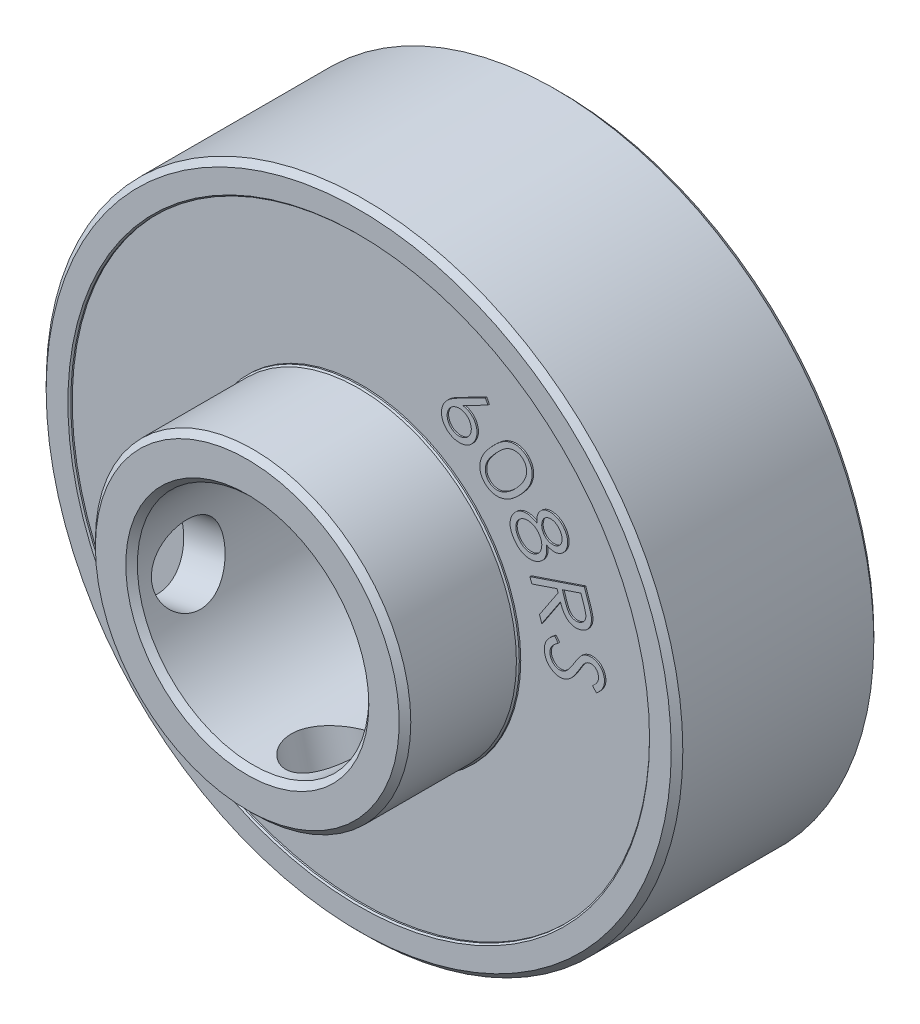
from build123d import *

# Parameters (mm, degrees)
SKETCH1_R                           = 11
SKETCH1_R_2                         = 4
BOSS_EXTRUDE1_DEPTH                 = 7
SKETCH2_R                           = 10
SKETCH2_R_2                         = 5.5
CUT_EXTRUDE1_DEPTH                  = 0.1
CUT_EXTRUDE2_START                  = -6.9
SKETCH2_2_R                         = 10
SKETCH2_2_R_2                       = 5.5
CUT_EXTRUDE2_DEPTH                  = 0.1
CHAMFER2_SIZE                       = 0.05
ESBO_O2_R                           = 5.45
ESBO_O2_R_2                         = 4
RESSALTO_EXTRUS_O1_DEPTH            = 3.85
BOSS_EXTRUDE2_DEPTH                 = 0.05
CHAMFER1_SIZE                       = 0.2
BOSS_EXTRUDE3_DEPTH                 = 0.05
FURO_ROSCADO_DE_M31_D               = 2.5
FURO_ROSCADO_DE_M31_DEPTH           = 7.5
FURO_ROSCADO_DE_M31_TIP             = 0.751075774
FURO_ROSCADO_DE_M31_ON_FACE_2_D     = 2.5
FURO_ROSCADO_DE_M31_ON_FACE_2_DEPTH = 7.5
FURO_ROSCADO_DE_M31_ON_FACE_2_TIP   = 0.751075774


with BuildPart() as part:
    # Sketch1 → Boss-Extrude1 (new body)
    with BuildSketch(Plane.XY):
        Circle(SKETCH1_R)
        Circle(SKETCH1_R_2, mode=Mode.SUBTRACT)
    extrude(amount=BOSS_EXTRUDE1_DEPTH)

    # Sketch2 → Cut-Extrude1 (cut)
    with BuildSketch(Plane.XY.offset(7)):
        Circle(SKETCH2_R)
        Circle(SKETCH2_R_2, mode=Mode.SUBTRACT)
    extrude(amount=-CUT_EXTRUDE1_DEPTH, mode=Mode.SUBTRACT)

    # Sketch2<2> → Cut-Extrude2 (cut)
    with BuildSketch(Plane.XY.offset(7).offset(CUT_EXTRUDE2_START)):
        Circle(SKETCH2_2_R)
        Circle(SKETCH2_2_R_2, mode=Mode.SUBTRACT)
    extrude(amount=-CUT_EXTRUDE2_DEPTH, mode=Mode.SUBTRACT)

    # Chamfer2
    chamfer2_edges = [part.edges().sort_by_distance(p)[0] for p in [
        (-10, 0, 7),
        (-5.5, 0, 7),
        (-10, 0, 0),
        (-5.5, 0, 0),
    ]]
    chamfer(chamfer2_edges, length=CHAMFER2_SIZE)

    # Esboço2 → Ressalto-extrusão1 (add)
    with BuildSketch(Plane.XY.offset(7)):
        Circle(ESBO_O2_R)
        Circle(ESBO_O2_R_2, mode=Mode.SUBTRACT)
    extrude(amount=RESSALTO_EXTRUS_O1_DEPTH)

    # Sketch3 → Boss-Extrude2 (add)
    # profile 1 of 5: a face of its own
    with BuildSketch(Plane(origin=(0, 0, 0.1), x_dir=(-1, 0, 0), z_dir=(0, 0, -1))):
        with BuildLine():
            Line((6.723953336, 1.374086402), (6.841741797, 1.216634479))
            add(Edge.make_bspline(
                [(6.841741797, 1.216634479), (6.817573288, 1.199359859), (6.771292818, 1.166280551), (6.7089583, 1.113159264), (6.65797847, 1.058354359), (6.616042027, 1.003718422), (6.585197602, 0.947642508), (6.564677897, 0.890789262), (6.554264641, 0.832905218), (6.556279326, 0.794387119), (6.557286669, 0.775128069)],
                knots=[0, 0, 0, 0, 1.292055059, 2.474166467, 3.555169481, 4.54276915, 5.463097752, 6.326728609, 7.163364304, 8, 8, 8, 8], degree=3))
            add(Edge.make_bspline(
                [(6.557286669, 0.775128069), (6.559589482, 0.75889953), (6.564156821, 0.726712276), (6.577499183, 0.679747808), (6.597073867, 0.635157474), (6.621192779, 0.592867963), (6.650084971, 0.554531373), (6.683420565, 0.521824686), (6.71962411, 0.494193194), (6.759139635, 0.472574946), (6.800541147, 0.456589651), (6.843001787, 0.446611622), (6.8860034, 0.441689172), (6.914655203, 0.443624683), (6.929081541, 0.444599223)],
                knots=[0, 0, 0, 0, 1.065647424, 2.113576877, 3.164384275, 4.227051853, 5.274981306, 6.276492859, 7.256630379, 8.228879028, 9.197081163, 10.13494145, 11.060932943, 12, 12, 12, 12], degree=3))
            add(Edge.make_bspline(
                [(6.929081541, 0.444599223), (6.945519436, 0.447087772), (6.978756008, 0.45211949), (7.026704444, 0.470689174), (7.073741901, 0.496394668), (7.101970562, 0.519552155), (7.116581541, 0.531538325)],
                knots=[0, 0, 0, 0, 0.947990027, 1.916786729, 2.921741833, 4, 4, 4, 4], degree=3))
            add(Edge.make_bspline(
                [(7.116581541, 0.531538325), (7.127135431, 0.541011836), (7.149222449, 0.560837855), (7.181222658, 0.595056366), (7.214764351, 0.633812728), (7.249572833, 0.677474782), (7.285307224, 0.726179014), (7.3219168, 0.780016687), (7.360652209, 0.838318589), (7.38569458, 0.879600754), (7.398632823, 0.900929351)],
                knots=[0, 0, 0, 0, 0.729441018, 1.526562937, 2.408317325, 3.366672661, 4.398852945, 5.515801495, 6.716528806, 8, 8, 8, 8], degree=3))
            add(Edge.make_bspline(
                [(7.398632823, 0.900929351), (7.411481182, 0.922096096), (7.436017587, 0.962518055), (7.472820572, 1.019379999), (7.50609449, 1.07074534), (7.537338687, 1.115557702), (7.565826722, 1.154147196), (7.591394823, 1.186795914), (7.614407064, 1.213420818), (7.629713327, 1.228338761), (7.636613592, 1.235063966)],
                knots=[0, 0, 0, 0, 1.445236574, 2.759956344, 3.953419532, 5.017350228, 5.948124348, 6.752849745, 7.43776821, 8, 8, 8, 8], degree=3))
            add(Edge.make_bspline(
                [(7.636613592, 1.235063966), (7.647453442, 1.244543907), (7.668850152, 1.263256302), (7.702463752, 1.288692966), (7.737555465, 1.310371795), (7.773613033, 1.328839241), (7.810780176, 1.344090457), (7.848714771, 1.356654507), (7.887907457, 1.365581106), (7.91448874, 1.368839266), (7.927879618, 1.370480633)],
                knots=[0, 0, 0, 0, 1.056756624, 2.085925105, 3.08957304, 4.080262677, 5.055903979, 6.035378084, 7.010280581, 8, 8, 8, 8], degree=3))
            add(Edge.make_bspline(
                [(7.927879618, 1.370480633), (7.948981269, 1.371870248), (7.990587385, 1.37461015), (8.052279005, 1.368496586), (8.111981804, 1.355515205), (8.168798048, 1.333504491), (8.222511066, 1.304967414), (8.271642008, 1.26880591), (8.315398275, 1.225611054), (8.35382237, 1.176261797), (8.385992991, 1.122092785), (8.41166226, 1.064244335), (8.429536588, 1.002885194), (8.435353033, 0.960458902), (8.438296284, 0.938990248)],
                knots=[0, 0, 0, 0, 1.01991207, 2.010960161, 2.982781706, 3.962746851, 4.943984954, 5.912890685, 6.898148972, 7.904611514, 8.925685622, 9.933656005, 10.954383679, 12, 12, 12, 12], degree=3))
            add(Edge.make_bspline(
                [(8.438296284, 0.938990248), (8.439905173, 0.916018968), (8.443100643, 0.870394895), (8.435954309, 0.802226976), (8.421251944, 0.735375989), (8.401131857, 0.681031699), (8.37977872, 0.638088379), (8.360564, 0.604548729), (8.337040201, 0.570775496), (8.310670734, 0.53558058), (8.279863744, 0.500254418), (8.246489716, 0.463106616), (8.208609747, 0.426121993), (8.181946924, 0.401530075), (8.168264233, 0.38891012)],
                knots=[0, 0, 0, 0, 1.294867467, 2.571782184, 3.843746611, 5.143215914, 5.822746795, 6.543964101, 7.318006915, 8.13942962, 9.019769218, 9.956863672, 10.951513765, 12, 12, 12, 12], degree=3))
            Line((8.168264233, 0.38891012), (8.029642438, 0.537547941))
            add(Edge.make_bspline(
                [(8.029642438, 0.537547941), (8.040491364, 0.547797716), (8.061430909, 0.567580842), (8.091198861, 0.596726402), (8.1177117, 0.624750316), (8.140998798, 0.651703899), (8.161430413, 0.677149832), (8.178807729, 0.701361339), (8.193307277, 0.724006553), (8.208313949, 0.752376209), (8.222111687, 0.78797107), (8.232490263, 0.831773931), (8.237254627, 0.876823898), (8.235338696, 0.906937777), (8.234370002, 0.922163325)],
                knots=[0, 0, 0, 0, 1.182699611, 2.282732375, 3.300866298, 4.238668036, 5.104698929, 5.88587987, 6.599324344, 7.233663973, 8.426546453, 9.612413994, 10.792838817, 12, 12, 12, 12], degree=3))
            add(Edge.make_bspline(
                [(8.234370002, 0.922163325), (8.231544844, 0.941132772), (8.226095153, 0.97772457), (8.207511221, 1.029103552), (8.179226125, 1.07342249), (8.143481188, 1.110786437), (8.101919482, 1.139998909), (8.056290048, 1.160326247), (8.006902954, 1.169811767), (7.973443836, 1.168186943), (7.956325131, 1.167355633)],
                knots=[0, 0, 0, 0, 1.109513479, 2.140235993, 3.138523126, 4.134648421, 5.117916045, 6.063936821, 7.00945106, 8, 8, 8, 8], degree=3))
            add(Edge.make_bspline(
                [(7.956325131, 1.167355633), (7.945745182, 1.165793238), (7.92452439, 1.162659454), (7.893216116, 1.154810012), (7.863019919, 1.142853978), (7.833191485, 1.128051735), (7.803915641, 1.108026169), (7.773495168, 1.083650001), (7.743435661, 1.052289809), (7.723571823, 1.029230065), (7.713136028, 1.017115248)],
                knots=[0, 0, 0, 0, 0.872627401, 1.750277355, 2.626708255, 3.518723759, 4.461878059, 5.515567722, 6.694762481, 8, 8, 8, 8], degree=3))
            add(Edge.make_bspline(
                [(7.713136028, 1.017115248), (7.709759885, 1.012601252), (7.701657657, 1.00176835), (7.688608104, 0.982001066), (7.672276268, 0.956433232), (7.65262288, 0.924978085), (7.629276842, 0.887948617), (7.60342511, 0.84439932), (7.573757222, 0.795347482), (7.552995234, 0.760582288), (7.54206231, 0.742275505)],
                knots=[0, 0, 0, 0, 0.417704147, 1.002426291, 1.754721007, 2.666443671, 3.751275867, 4.998903859, 6.419671761, 8, 8, 8, 8], degree=3))
            add(Edge.make_bspline(
                [(7.54206231, 0.742275505), (7.528720878, 0.72014766), (7.502869753, 0.677271475), (7.462909444, 0.616494005), (7.424908705, 0.560118495), (7.386533341, 0.509633022), (7.349495907, 0.463846731), (7.313037636, 0.423278472), (7.277439614, 0.387815365), (7.231706317, 0.348414155), (7.174122265, 0.307697522), (7.102778014, 0.269865497), (7.029575045, 0.243643782), (6.979473401, 0.23602383), (6.954722566, 0.232259479)],
                knots=[0, 0, 0, 0, 1.151589416, 2.231385892, 3.241866087, 4.181198595, 5.056967968, 5.86622306, 6.611257172, 7.295010099, 8.555133183, 9.745337415, 10.8861687, 12, 12, 12, 12], degree=3))
            add(Edge.make_bspline(
                [(6.954722566, 0.232259479), (6.937104145, 0.230954156), (6.902273291, 0.228373588), (6.850287945, 0.230996996), (6.799553841, 0.238604602), (6.7498888, 0.251362609), (6.70178582, 0.270191913), (6.654518449, 0.293243368), (6.609132064, 0.322693373), (6.565113537, 0.35621304), (6.524107945, 0.393956855), (6.487534332, 0.434933646), (6.45562657, 0.478557564), (6.428202178, 0.524760922), (6.405676349, 0.573922386), (6.388114701, 0.625763552), (6.37509852, 0.680239147), (6.370249322, 0.717645223), (6.367783464, 0.73666653)],
                knots=[0, 0, 0, 0, 0.985637329, 1.948562123, 2.898699275, 3.846375535, 4.804641011, 5.778360361, 6.777444169, 7.819911255, 8.864722404, 9.88397061, 10.881717925, 11.877903731, 12.878850076, 13.895148367, 14.929665032, 16, 16, 16, 16], degree=3))
            add(Edge.make_bspline(
                [(6.367783464, 0.73666653), (6.366427586, 0.751479961), (6.36374365, 0.780802889), (6.364781078, 0.824712107), (6.366958187, 0.867892434), (6.373888092, 0.910243045), (6.38267062, 0.952061727), (6.395985544, 0.99277455), (6.410879198, 1.033227048), (6.430041569, 1.072638466), (6.452506534, 1.111705681), (6.479103013, 1.150236727), (6.509821859, 1.188344837), (6.544257517, 1.226550474), (6.583270723, 1.264064543), (6.626226549, 1.301327262), (6.673295047, 1.338362343), (6.706747289, 1.361952754), (6.723953336, 1.374086402)],
                knots=[0, 0, 0, 0, 0.924783812, 1.830593555, 2.729938474, 3.612542721, 4.497647048, 5.385983185, 6.274940971, 7.178116819, 8.108855036, 9.07694148, 10.087910257, 11.152769032, 12.275211649, 13.45327497, 14.690100631, 16, 16, 16, 16], degree=3))
        make_face()
    # profile 2 of 5: a face of its own
    with BuildSketch(Plane(origin=(0, 0, 0.1), x_dir=(-1, 0, 0), z_dir=(0, 0, -1))):
        with BuildLine():
            Line((7.746137114, 3.357649879), (7.872739678, 2.983451161))
            add(Edge.make_bspline(
                [(7.872739678, 2.983451161), (7.881059185, 2.958357449), (7.896967784, 2.910373143), (7.919192418, 2.841249827), (7.93827157, 2.778162874), (7.954988951, 2.721116942), (7.968277975, 2.670083531), (7.97810167, 2.624967975), (7.986304921, 2.586220173), (7.989206196, 2.562134117), (7.99052814, 2.551159494)],
                knots=[0, 0, 0, 0, 1.41401025, 2.703876705, 3.883389485, 4.939117467, 5.883308228, 6.703003456, 7.409033675, 8, 8, 8, 8], degree=3))
            add(Edge.make_bspline(
                [(7.99052814, 2.551159494), (7.991680371, 2.536346044), (7.993961878, 2.507014281), (7.99355178, 2.463189389), (7.989536296, 2.420458725), (7.982244147, 2.378807362), (7.971867446, 2.338150413), (7.957859366, 2.298427821), (7.940049121, 2.259949253), (7.919392559, 2.222682043), (7.895267023, 2.187520322), (7.868522083, 2.15435442), (7.838146422, 2.124526727), (7.805654899, 2.096319063), (7.769505392, 2.071821996), (7.730676725, 2.049581161), (7.689074117, 2.029824145), (7.65969703, 2.019263938), (7.644774935, 2.013899879)],
                knots=[0, 0, 0, 0, 1.027353843, 2.034239082, 3.026914782, 3.992754084, 4.956116645, 5.926055136, 6.901519887, 7.885736109, 8.869562139, 9.847691085, 10.827432488, 11.810304063, 12.819812835, 13.841795782, 14.903739854, 16, 16, 16, 16], degree=3))
            add(Edge.make_bspline(
                [(7.644774935, 2.013899879), (7.619571721, 2.006225956), (7.570483848, 1.991279587), (7.495245456, 1.981482942), (7.421726968, 1.981550073), (7.350113043, 1.99285135), (7.28164526, 2.01459628), (7.217050526, 2.046407449), (7.157909987, 2.089546729), (7.111856988, 2.132170274), (7.078246075, 2.172604827), (7.052872874, 2.206693439), (7.028502864, 2.24470871), (7.00542963, 2.286885007), (6.981948203, 2.332291093), (6.960215509, 2.382102891), (6.938952909, 2.435460163), (6.925647847, 2.472458787), (6.918813396, 2.491463981)],
                knots=[0, 0, 0, 0, 1.278263464, 2.489652168, 3.670679834, 4.839936614, 5.997393751, 7.149490657, 8.321732671, 9.542815408, 10.187555536, 10.874109659, 11.606713321, 12.379429923, 13.209421677, 14.089665205, 15.018712606, 16, 16, 16, 16], degree=3))
            Line((6.918813396, 2.491463981), (6.274181986, 1.519909494))
            Line((6.274181986, 1.519909494), (6.195656345, 1.75268193))
            Line((6.195656345, 1.75268193), (6.840688396, 2.722633853))
            Line((6.840688396, 2.722633853), (6.804630704, 2.829605007))
            Line((6.804630704, 2.829605007), (5.931233268, 2.53393193))
            Line((5.931233268, 2.53393193), (5.867531345, 2.721832571))
            Line((5.867531345, 2.721832571), (7.746137114, 3.357649879))
        make_face()
        with BuildLine():
            Line((7.625944806, 3.107649879), (6.987323011, 2.891303725))
            Line((6.987323011, 2.891303725), (7.093893524, 2.567585776))
            add(Edge.make_bspline(
                [(7.093893524, 2.567585776), (7.099141602, 2.552460366), (7.109268083, 2.523274973), (7.12546665, 2.481526975), (7.141165795, 2.442969417), (7.157905934, 2.408224542), (7.173577508, 2.37635315), (7.19005439, 2.34833638), (7.206517147, 2.323717963), (7.228098548, 2.295648952), (7.257158343, 2.265709238), (7.296463649, 2.236869944), (7.338965987, 2.214103265), (7.38510297, 2.199047445), (7.432884658, 2.190547052), (7.481570808, 2.189590563), (7.530612026, 2.194710922), (7.562229046, 2.204464605), (7.578268524, 2.209412699)],
                knots=[0, 0, 0, 0, 1.118554581, 2.158318542, 3.128777667, 4.026236993, 4.852521549, 5.609511046, 6.2953485, 6.920617761, 8.081985124, 9.196171859, 10.314843201, 11.436157874, 12.572935431, 13.69304583, 14.829670183, 16, 16, 16, 16], degree=3))
            add(Edge.make_bspline(
                [(7.578268524, 2.209412699), (7.59342902, 2.215251964), (7.62342383, 2.226804859), (7.664579795, 2.251684726), (7.701464878, 2.282014563), (7.733367565, 2.317620085), (7.759719917, 2.357194019), (7.780045409, 2.399320856), (7.793065142, 2.44385535), (7.798012121, 2.482767203), (7.798617957, 2.516069958), (7.796430694, 2.544330853), (7.791830588, 2.575579595), (7.785411015, 2.609926292), (7.776957572, 2.647370858), (7.766058218, 2.687842945), (7.752740917, 2.731460489), (7.742856393, 2.761514748), (7.737723652, 2.777121033)],
                knots=[0, 0, 0, 0, 1.157480747, 2.290057996, 3.413820966, 4.554229024, 5.688088466, 6.796349954, 7.878911532, 8.984095935, 9.584534887, 10.253304793, 11.003966908, 11.837573395, 12.74613744, 13.742422656, 14.827707137, 16, 16, 16, 16], degree=3))
            Line((7.737723652, 2.777121033), (7.625944806, 3.107649879))
        make_face(mode=Mode.SUBTRACT)
    # profile 3 of 5: a face of its own
    with BuildSketch(Plane(origin=(0, 0, 0.1), x_dir=(-1, 0, 0), z_dir=(0, 0, -1))):
        with BuildLine():
            add(Edge.make_bspline(
                [(6.436645373, 3.958851709), (6.438849744, 3.940573746), (6.443153326, 3.904889774), (6.446080097, 3.852458084), (6.447345332, 3.802571834), (6.444615596, 3.755237655), (6.440242818, 3.710182835), (6.431945321, 3.667690701), (6.421801836, 3.627540907), (6.408467872, 3.589869698), (6.392118978, 3.554645749), (6.374421381, 3.520656156), (6.353059749, 3.489126668), (6.330588283, 3.458332588), (6.304473045, 3.429986163), (6.276658623, 3.402650225), (6.246016539, 3.377299569), (6.224148017, 3.36201487), (6.213087681, 3.354284402)],
                knots=[0, 0, 0, 0, 1.290890309, 2.520198396, 3.681805585, 4.788490099, 5.843551436, 6.853927339, 7.821726867, 8.74603337, 9.651448064, 10.544029729, 11.429902383, 12.319727641, 13.215057227, 14.129151139, 15.053789794, 16, 16, 16, 16], degree=3))
            add(Edge.make_bspline(
                [(6.213087681, 3.354284402), (6.197080539, 3.344144505), (6.165376402, 3.324061175), (6.115609733, 3.298721518), (6.064443052, 3.278646051), (6.012154311, 3.263322512), (5.958510855, 3.252871046), (5.903673026, 3.247212262), (5.847609117, 3.246868388), (5.810160039, 3.250090216), (5.791212681, 3.251720299)],
                knots=[0, 0, 0, 0, 1.02459754, 2.029343036, 3.015319328, 3.993724459, 4.972689464, 5.967517749, 6.971665777, 8, 8, 8, 8], degree=3))
            add(Edge.make_bspline(
                [(5.791212681, 3.251720299), (5.76812279, 3.255152686), (5.722105673, 3.26199328), (5.655371216, 3.282467937), (5.591465368, 3.310695655), (5.530691013, 3.347287029), (5.472409223, 3.391028314), (5.417139616, 3.44291569), (5.364964002, 3.502778785), (5.333693598, 3.547097948), (5.317654988, 3.569829274)],
                knots=[0, 0, 0, 0, 0.94927729, 1.891867025, 2.831441269, 3.787189233, 4.773456595, 5.792841766, 6.867947176, 8, 8, 8, 8], degree=3))
            add(Edge.make_bspline(
                [(5.317654988, 3.569829274), (5.303063571, 3.592276258), (5.274661246, 3.635969511), (5.240442419, 3.70396576), (5.213126694, 3.770723532), (5.193673612, 3.836759996), (5.18189304, 3.902041339), (5.177652501, 3.9664582), (5.181746591, 4.030123994), (5.193666901, 4.092147537), (5.210811163, 4.152011519), (5.232533781, 4.208453206), (5.257704373, 4.261497857), (5.287473484, 4.310315858), (5.320899663, 4.355598373), (5.358263051, 4.396995678), (5.399718813, 4.434649249), (5.43013903, 4.456340746), (5.445459476, 4.467265171)],
                knots=[0, 0, 0, 0, 1.265189782, 2.462703114, 3.593198436, 4.67234407, 5.711673085, 6.724080211, 7.71757927, 8.719632106, 9.70506986, 10.658584755, 11.576575664, 12.477685061, 13.358041525, 14.234425087, 15.110808649, 16, 16, 16, 16], degree=3))
            add(Edge.make_bspline(
                [(5.445459476, 4.467265171), (5.456987966, 4.474624406), (5.480000329, 4.489314395), (5.515649837, 4.508441139), (5.552366299, 4.524126629), (5.589327481, 4.537519912), (5.627481553, 4.547343512), (5.665928122, 4.555312832), (5.705401353, 4.558925918), (5.745399858, 4.560814177), (5.786673455, 4.559096182), (5.829078302, 4.554049573), (5.872697014, 4.544281293), (5.91778122, 4.532182679), (5.964098431, 4.515785424), (6.011833619, 4.496274612), (6.060588671, 4.472457347), (6.093098017, 4.454707355), (6.109722296, 4.445630556)],
                knots=[0, 0, 0, 0, 0.931334836, 1.859065266, 2.751202648, 3.648748233, 4.533436264, 5.43245535, 6.319384756, 7.229651734, 8.158095254, 9.129430785, 10.133761898, 11.19951572, 12.306952597, 13.477470392, 14.710056011, 16, 16, 16, 16], degree=3))
            add(Edge.make_bspline(
                [(6.109722296, 4.445630556), (6.107482301, 4.47205299), (6.10313889, 4.52328682), (6.107287375, 4.598282233), (6.11985051, 4.668288878), (6.14164351, 4.732865757), (6.171434346, 4.791786736), (6.208476731, 4.844446438), (6.252045054, 4.891203726), (6.28610488, 4.91622277), (6.303231911, 4.928803633)],
                knots=[0, 0, 0, 0, 1.159116483, 2.247558892, 3.275615725, 4.262372356, 5.218835671, 6.154236364, 7.07185513, 8, 8, 8, 8], degree=3))
            add(Edge.make_bspline(
                [(6.303231911, 4.928803633), (6.321754889, 4.940084937), (6.359014229, 4.962777505), (6.421256217, 4.986222737), (6.488036273, 5.000993457), (6.558445944, 5.007117844), (6.630670913, 5.005090507), (6.702669609, 4.992413163), (6.77329377, 4.969774079), (6.841463499, 4.937151075), (6.906181416, 4.896456921), (6.965941656, 4.848096386), (7.019799943, 4.792057066), (7.050247347, 4.749841495), (7.065651783, 4.72848312)],
                knots=[0, 0, 0, 0, 0.892779067, 1.795842916, 2.727080536, 3.70581188, 4.703144711, 5.698163754, 6.710047702, 7.752069251, 8.806330382, 9.855631886, 10.91508709, 12, 12, 12, 12], degree=3))
            add(Edge.make_bspline(
                [(7.065651783, 4.72848312), (7.079336383, 4.706774175), (7.106401224, 4.663839111), (7.136261198, 4.594226894), (7.157475004, 4.522286133), (7.168858659, 4.44845505), (7.171401759, 4.374581199), (7.164611604, 4.302250625), (7.148558493, 4.232231558), (7.122885922, 4.165630452), (7.089294662, 4.103906053), (7.0495902, 4.047721731), (7.002341174, 3.999113654), (6.966283703, 3.972535032), (6.948263963, 3.95925235)],
                knots=[0, 0, 0, 0, 1.068771019, 2.113771646, 3.146516798, 4.18939315, 5.220229497, 6.221594843, 7.210477599, 8.206485729, 9.188317762, 10.134173663, 11.067552274, 12, 12, 12, 12], degree=3))
            add(Edge.make_bspline(
                [(6.948263963, 3.95925235), (6.92948131, 3.947579211), (6.892704816, 3.924723167), (6.832726752, 3.900840341), (6.770949722, 3.886814804), (6.707208907, 3.88185386), (6.641795956, 3.887028294), (6.57452711, 3.90142974), (6.505301459, 3.925243395), (6.460060234, 3.947389739), (6.436645373, 3.958851709)],
                knots=[0, 0, 0, 0, 0.981875121, 1.922514633, 2.854567088, 3.789622669, 4.754286786, 5.76174218, 6.841576559, 8, 8, 8, 8], degree=3))
        make_face()
        with BuildLine():
            add(Edge.make_bspline(
                [(6.899786399, 4.627521581), (6.89206632, 4.638457323), (6.87685916, 4.659998761), (6.851731015, 4.689696603), (6.824543522, 4.715861262), (6.79632334, 4.739189166), (6.766173857, 4.759065259), (6.734647119, 4.775820377), (6.701543011, 4.789622008), (6.667263629, 4.799834203), (6.632827413, 4.807110393), (6.598864764, 4.810677554), (6.565845271, 4.811257308), (6.533573133, 4.808043896), (6.502305027, 4.801150813), (6.471895114, 4.791090338), (6.442508709, 4.777396374), (6.423983999, 4.765933971), (6.414610117, 4.760133761)],
                knots=[0, 0, 0, 0, 1.147797877, 2.260954539, 3.330167184, 4.38025149, 5.396817843, 6.421610434, 7.438370352, 8.467442645, 9.485040915, 10.452679454, 11.391973248, 12.312859485, 13.227240642, 14.132754951, 15.055135845, 16, 16, 16, 16], degree=3))
            add(Edge.make_bspline(
                [(6.414610117, 4.760133761), (6.405774199, 4.753786345), (6.388108367, 4.741095827), (6.364373565, 4.718498267), (6.343734102, 4.693036444), (6.324762197, 4.66560438), (6.309508042, 4.635122756), (6.296405059, 4.602338894), (6.286620035, 4.566820361), (6.27902636, 4.529487679), (6.274755334, 4.491152689), (6.273205383, 4.453199531), (6.276275975, 4.416049243), (6.282273469, 4.379861769), (6.29134367, 4.344469632), (6.304515391, 4.310097751), (6.320673305, 4.276359421), (6.334378057, 4.255189882), (6.341292809, 4.244508761)],
                knots=[0, 0, 0, 0, 0.908844192, 1.81707094, 2.729132775, 3.645761934, 4.599514883, 5.571907187, 6.593318126, 7.675011067, 8.753876802, 9.815092739, 10.84525358, 11.863975947, 12.879511735, 13.893573417, 14.937199413, 16, 16, 16, 16], degree=3))
            add(Edge.make_bspline(
                [(6.341292809, 4.244508761), (6.350814274, 4.231255034), (6.369827412, 4.204789049), (6.404691636, 4.170598056), (6.443344082, 4.140394154), (6.485652106, 4.115036742), (6.53091205, 4.095367527), (6.577788532, 4.082025189), (6.625777609, 4.074990316), (6.673984131, 4.075405122), (6.721007008, 4.080627131), (6.765184168, 4.092077638), (6.806448491, 4.107815252), (6.831074035, 4.122859441), (6.843296014, 4.130326068)],
                knots=[0, 0, 0, 0, 1.029778083, 2.056334151, 3.072742447, 4.125103068, 5.164692881, 6.18264204, 7.197261409, 8.21856438, 9.221531217, 10.179595353, 11.096509409, 12, 12, 12, 12], degree=3))
            add(Edge.make_bspline(
                [(6.843296014, 4.130326068), (6.851446438, 4.13616324), (6.867594435, 4.147728114), (6.88939698, 4.168131937), (6.90904658, 4.190508833), (6.92640353, 4.215277105), (6.941639015, 4.242075679), (6.954455745, 4.271261696), (6.965288178, 4.302452796), (6.973600755, 4.335686204), (6.979511889, 4.370209731), (6.980683648, 4.405777115), (6.977172407, 4.441591107), (6.970465098, 4.478043747), (6.9591051, 4.514969221), (6.943248573, 4.552252268), (6.923519635, 4.590151684), (6.907856867, 4.614813977), (6.899786399, 4.627521581)],
                knots=[0, 0, 0, 0, 0.860567069, 1.704995385, 2.558804371, 3.415153889, 4.298967395, 5.203031682, 6.150124742, 7.132495547, 8.143595732, 9.153914339, 10.17923786, 11.230179396, 12.333615959, 13.490750709, 14.707072956, 16, 16, 16, 16], degree=3))
        make_face(mode=Mode.SUBTRACT)
        with BuildLine():
            add(Edge.make_bspline(
                [(6.192654988, 4.141544017), (6.183073031, 4.155401294), (6.164227572, 4.182655302), (6.131187317, 4.218933327), (6.097015473, 4.252070626), (6.059989677, 4.280785033), (6.020837675, 4.305788703), (5.978908288, 4.326108106), (5.934953683, 4.342757084), (5.889255118, 4.354794419), (5.843074833, 4.363522847), (5.797427161, 4.366805064), (5.753115121, 4.366894985), (5.710232395, 4.361231726), (5.668413788, 4.352462102), (5.628232574, 4.337906769), (5.58882321, 4.320171181), (5.564407056, 4.304523989), (5.552029988, 4.296592094)],
                knots=[0, 0, 0, 0, 1.103096915, 2.169532516, 3.209705979, 4.22005898, 5.235178716, 6.249127762, 7.268541052, 8.31114268, 9.343069619, 10.344088993, 11.307028603, 12.241865975, 13.174241085, 14.101672058, 15.037697202, 16, 16, 16, 16], degree=3))
            add(Edge.make_bspline(
                [(5.552029988, 4.296592094), (5.53739373, 4.285920167), (5.508158373, 4.264603408), (5.470459325, 4.225147952), (5.438160928, 4.180583136), (5.411429753, 4.131524815), (5.391128257, 4.078821031), (5.379712135, 4.02334043), (5.375573245, 3.966204794), (5.379709706, 3.907692931), (5.391978104, 3.848519155), (5.411845955, 3.789219006), (5.439605058, 3.729865997), (5.463581076, 3.692173419), (5.475908194, 3.672794017)],
                knots=[0, 0, 0, 0, 0.926109246, 1.849867156, 2.780058085, 3.737943589, 4.703270699, 5.660960876, 6.627667837, 7.628486545, 8.654526651, 9.714225142, 10.824783286, 12, 12, 12, 12], degree=3))
            add(Edge.make_bspline(
                [(5.475908194, 3.672794017), (5.486060461, 3.658170197), (5.505883669, 3.629615884), (5.539352829, 3.591150094), (5.574498341, 3.557119283), (5.611193238, 3.52754691), (5.649610266, 3.502113814), (5.690285635, 3.482258235), (5.73254201, 3.466467844), (5.776087466, 3.455386323), (5.819965834, 3.44854851), (5.863310687, 3.446190652), (5.905570882, 3.447721693), (5.946649447, 3.453327605), (5.986515083, 3.463003588), (6.025261611, 3.476638949), (6.062787941, 3.494832298), (6.086485292, 3.509769369), (6.098504347, 3.517345299)],
                knots=[0, 0, 0, 0, 1.19035752, 2.32427924, 3.40484362, 4.459799014, 5.473418872, 6.48040078, 7.481219341, 8.486773131, 9.481309882, 10.447796045, 11.386669185, 12.306601008, 13.216804754, 14.126789189, 15.049926509, 16, 16, 16, 16], degree=3))
            add(Edge.make_bspline(
                [(6.098504347, 3.517345299), (6.109623379, 3.525413647), (6.131612455, 3.541369668), (6.161538623, 3.568937135), (6.18821179, 3.599437638), (6.210866349, 3.633334346), (6.230793072, 3.669716469), (6.247216973, 3.709047676), (6.259874558, 3.751393122), (6.269542145, 3.795841921), (6.274911413, 3.841443699), (6.276921551, 3.886781556), (6.273360853, 3.931306877), (6.266335015, 3.975088203), (6.254596548, 4.018173699), (6.238424813, 4.06039773), (6.21802423, 4.101939076), (6.201197342, 4.128208206), (6.192654988, 4.141544017)],
                knots=[0, 0, 0, 0, 0.942671861, 1.864234432, 2.78725575, 3.718123832, 4.657802721, 5.631928245, 6.638488188, 7.688830978, 8.751153965, 9.788000563, 10.799352584, 11.812407604, 12.828984143, 13.859322421, 14.913261601, 16, 16, 16, 16], degree=3))
        make_face(mode=Mode.SUBTRACT)
    # profile 4 of 5: a face of its own
    with BuildSketch(Plane(origin=(0, 0, 0.1), x_dir=(-1, 0, 0), z_dir=(0, 0, -1))):
        with BuildLine():
            add(Edge.make_bspline(
                [(4.543033426, 5.949335529), (4.564943157, 5.972693181), (4.607527355, 6.018091587), (4.67157506, 6.0821776), (4.733665606, 6.140505217), (4.794137626, 6.192741517), (4.85293655, 6.238729797), (4.909649751, 6.279135227), (4.964441144, 6.313866459), (5.018164906, 6.342452083), (5.070566701, 6.366205448), (5.122024451, 6.38603643), (5.172895525, 6.401712181), (5.223134838, 6.413290127), (5.272621026, 6.421532789), (5.321665929, 6.425568094), (5.370160168, 6.42549656), (5.417968316, 6.42189385), (5.464631842, 6.414853045), (5.509827437, 6.403785557), (5.553710443, 6.389848585), (5.596047144, 6.372253298), (5.636808987, 6.351171515), (5.676066811, 6.327121226), (5.714074787, 6.299926787), (5.737519741, 6.279144916), (5.749363554, 6.268646427)],
                knots=[0, 0, 0, 0, 1.642537938, 3.192470103, 4.646338539, 6.011168142, 7.289605298, 8.473669563, 9.581665276, 10.614373007, 11.59226402, 12.531086133, 13.441104306, 14.320069679, 15.173659948, 16.012137794, 16.84096325, 17.65841702, 18.469272155, 19.258427056, 20.042601694, 20.82874835, 21.606886513, 22.39398752, 23.188682081, 24, 24, 24, 24], degree=3))
            add(Edge.make_bspline(
                [(5.749363554, 6.268646427), (5.760911716, 6.257617316), (5.783832443, 6.2357268), (5.814606127, 6.199685182), (5.842763625, 6.162273296), (5.86720813, 6.122744115), (5.888632845, 6.081687155), (5.906688759, 6.038659944), (5.921436917, 5.993756214), (5.933125957, 5.947322605), (5.941123235, 5.899359884), (5.945576238, 5.850210478), (5.945937318, 5.799696325), (5.942178582, 5.748167993), (5.934948076, 5.695283356), (5.923723996, 5.64133292), (5.908257359, 5.586132596), (5.889035669, 5.529625786), (5.865374627, 5.471491833), (5.83582998, 5.412255968), (5.80126516, 5.351314775), (5.761491532, 5.288687708), (5.716170301, 5.224741752), (5.665349958, 5.159251463), (5.609380215, 5.092013278), (5.569231642, 5.047489171), (5.5486424, 5.024656042)],
                knots=[0, 0, 0, 0, 0.812736739, 1.613115341, 2.410193159, 3.195255584, 3.977011722, 4.766451224, 5.568648116, 6.381840011, 7.202505524, 8.042362829, 8.892510741, 9.771967907, 10.671265438, 11.608935862, 12.575845681, 13.588824347, 14.647177854, 15.769502049, 16.957239641, 18.213799721, 19.545973321, 20.947120805, 22.434403522, 24, 24, 24, 24], degree=3))
            add(Edge.make_bspline(
                [(5.5486424, 5.024656042), (5.527680493, 5.002353903), (5.486797486, 4.958856979), (5.424765374, 4.897538301), (5.363751907, 4.841756827), (5.304193874, 4.791136914), (5.245683972, 4.746127832), (5.188196251, 4.706632475), (5.131917607, 4.672564327), (5.076622511, 4.643827313), (5.022302089, 4.620150633), (4.968866404, 4.60056073), (4.916443523, 4.584153257), (4.864386266, 4.572744454), (4.813189003, 4.564345172), (4.762509713, 4.561020629), (4.712689965, 4.560768112), (4.663807528, 4.564917701), (4.616099552, 4.572413487), (4.569931105, 4.58374163), (4.525340014, 4.598193132), (4.482211508, 4.615751886), (4.440882307, 4.637302377), (4.400706003, 4.661523567), (4.362510463, 4.689746565), (4.338690087, 4.710774866), (4.326687272, 4.721370786)],
                knots=[0, 0, 0, 0, 1.559433233, 3.041436978, 4.443008781, 5.770818333, 7.022943957, 8.202580838, 9.32288808, 10.372875569, 11.375398524, 12.339881119, 13.271916542, 14.171621232, 15.053181812, 15.912749435, 16.756523382, 17.589472185, 18.409479342, 19.214872608, 20.008917662, 20.796169375, 21.584390954, 22.381462505, 23.184437513, 24, 24, 24, 24], degree=3))
            add(Edge.make_bspline(
                [(4.326687272, 4.721370786), (4.315260387, 4.732257291), (4.292582092, 4.753863126), (4.262524999, 4.789474989), (4.234216651, 4.825811541), (4.210591491, 4.864827354), (4.189388006, 4.905106752), (4.171852571, 4.947252998), (4.157409917, 4.991049596), (4.146081336, 5.036416821), (4.1385724, 5.083328133), (4.134475716, 5.131406743), (4.134526669, 5.180589449), (4.138668218, 5.230653261), (4.146378676, 5.281762522), (4.157589801, 5.333992266), (4.172890384, 5.387243797), (4.192316993, 5.44187928), (4.216511887, 5.49808747), (4.245828348, 5.556425299), (4.281385112, 5.616628969), (4.322888369, 5.67887757), (4.369244831, 5.744006213), (4.421956893, 5.810719564), (4.480129534, 5.879757147), (4.521656172, 5.925690016), (4.543033426, 5.949335529)],
                knots=[0, 0, 0, 0, 0.809667474, 1.606901415, 2.389915423, 3.171938179, 3.944739181, 4.725317868, 5.512374, 6.310580304, 7.123290289, 7.948912628, 8.785395908, 9.645186643, 10.525642855, 11.437417869, 12.385812245, 13.368196359, 14.41253519, 15.525600646, 16.717987141, 17.999697683, 19.365829755, 20.821103961, 22.363554732, 24, 24, 24, 24], degree=3))
        make_face()
        with BuildLine():
            add(Edge.make_bspline(
                [(4.679251375, 5.818325914), (4.660851677, 5.798119355), (4.625169821, 5.75893352), (4.575066406, 5.700527005), (4.530060028, 5.644381866), (4.490109119, 5.590608243), (4.454150268, 5.539934716), (4.423546398, 5.49144367), (4.398220443, 5.445165553), (4.377241144, 5.40129025), (4.35988931, 5.359114478), (4.347091963, 5.31763911), (4.335718979, 5.277328241), (4.328855361, 5.237439496), (4.323935339, 5.198395489), (4.323658489, 5.159929724), (4.324705927, 5.122099941), (4.332062828, 5.073644615), (4.346039936, 5.016229297), (4.372941953, 4.953168665), (4.40806014, 4.896592751), (4.438775126, 4.865487268), (4.454091118, 4.849976555)],
                knots=[0, 0, 0, 0, 1.475488141, 2.861359785, 4.154121984, 5.359730204, 6.477947551, 7.508249804, 8.453740252, 9.324547233, 10.133287385, 10.913161477, 11.667000762, 12.392548848, 13.096455606, 13.788819075, 14.467224618, 15.137185669, 16.431314552, 17.646052312, 18.826206712, 20, 20, 20, 20], degree=3))
            add(Edge.make_bspline(
                [(4.454091118, 4.849976555), (4.470998304, 4.835844543), (4.504676122, 4.807694658), (4.563731671, 4.776736661), (4.628146618, 4.755513764), (4.685580759, 4.74573126), (4.73346006, 4.743796713), (4.770607522, 4.744784191), (4.808256766, 4.749765726), (4.846476655, 4.7579731), (4.885356808, 4.768707571), (4.924789742, 4.782747964), (4.964461886, 4.800624278), (4.990744591, 4.814196805), (5.004171247, 4.821130401)],
                knots=[0, 0, 0, 0, 1.34190696, 2.672975875, 4.03914862, 5.469008549, 6.211498008, 6.961821166, 7.734266787, 8.525620103, 9.346360653, 10.194610762, 11.077707539, 12, 12, 12, 12], degree=3))
            add(Edge.make_bspline(
                [(5.004171247, 4.821130401), (5.020977638, 4.830421862), (5.055134219, 4.849305423), (5.105185594, 4.881764095), (5.155673749, 4.917150584), (5.205669506, 4.95682755), (5.256454512, 4.999267098), (5.306984725, 5.045647846), (5.35784608, 5.095550455), (5.390788359, 5.130831575), (5.407616759, 5.14885476)],
                knots=[0, 0, 0, 0, 0.882398032, 1.79334748, 2.740232888, 3.715191852, 4.725879822, 5.7816566, 6.866770249, 8, 8, 8, 8], degree=3))
            add(Edge.make_bspline(
                [(5.407616759, 5.14885476), (5.424180747, 5.167029522), (5.45658333, 5.202583114), (5.501733152, 5.256702416), (5.543098053, 5.309660342), (5.58077131, 5.361374876), (5.615025998, 5.411615164), (5.644765307, 5.461224488), (5.670823679, 5.509629921), (5.693361068, 5.556938809), (5.712272001, 5.603065203), (5.727612485, 5.647874505), (5.739126559, 5.691583045), (5.748400632, 5.733736142), (5.752834323, 5.774825331), (5.755220583, 5.814429798), (5.753676352, 5.852830865), (5.746508693, 5.901432573), (5.732173642, 5.958555869), (5.706135375, 6.021663456), (5.67073215, 6.07767327), (5.640308497, 6.108613984), (5.625164836, 6.124015016)],
                knots=[0, 0, 0, 0, 1.327465575, 2.596797036, 3.803974219, 4.954802096, 6.050653377, 7.085610932, 8.075932289, 9.017660852, 9.913387465, 10.766122373, 11.572387875, 12.35293663, 13.093430198, 13.800930815, 14.493692928, 15.163603914, 16.450647312, 17.662487793, 18.836481221, 20, 20, 20, 20], degree=3))
            add(Edge.make_bspline(
                [(5.625164836, 6.124015016), (5.608285103, 6.138200877), (5.574619324, 6.166493862), (5.514977812, 6.196712457), (5.450201973, 6.218295255), (5.392180613, 6.227466046), (5.343795213, 6.230492325), (5.306274605, 6.228545799), (5.268394949, 6.224194501), (5.229871713, 6.21704111), (5.190985821, 6.205984316), (5.151532352, 6.192011613), (5.111544201, 6.174986568), (5.070779705, 6.154839157), (5.028631981, 6.130550497), (4.984923072, 6.100987844), (4.939041603, 6.06649501), (4.89071745, 6.027165691), (4.840939904, 5.982142624), (4.788729648, 5.932288445), (4.734224356, 5.877502417), (4.697964293, 5.838469719), (4.679251375, 5.818325914)],
                knots=[0, 0, 0, 0, 1.186933895, 2.367280006, 3.582519422, 4.861472594, 5.525769364, 6.196917143, 6.886441279, 7.583575583, 8.309531112, 9.066613021, 9.841978912, 10.654534034, 11.520211795, 12.46606624, 13.501419929, 14.618477826, 15.828573167, 17.123883194, 18.515707565, 20, 20, 20, 20], degree=3))
        make_face(mode=Mode.SUBTRACT)
    # profile 5 of 5: a face of its own
    with BuildSketch(Plane(origin=(0, 0, 0.1), x_dir=(-1, 0, 0), z_dir=(0, 0, -1))):
        with BuildLine():
            Line((4.324964443, 7.302356675), (4.416310597, 7.130481675))
            Line((4.416310597, 7.130481675), (3.555733674, 6.680962444))
            add(Edge.make_bspline(
                [(3.555733674, 6.680962444), (3.573820412, 6.677343593), (3.609234202, 6.670257891), (3.660020503, 6.655631802), (3.706959766, 6.637037992), (3.736127944, 6.622159713), (3.750445212, 6.614856675)],
                knots=[0, 0, 0, 0, 1.071524611, 2.098042594, 3.06641979, 4, 4, 4, 4], degree=3))
            add(Edge.make_bspline(
                [(3.750445212, 6.614856675), (3.767080526, 6.605028081), (3.79973166, 6.585736909), (3.844667082, 6.551553291), (3.885064799, 6.513987171), (3.921262857, 6.472864589), (3.951945795, 6.427668961), (3.978773631, 6.379220739), (4.000582274, 6.327012973), (4.018191547, 6.272085969), (4.030461657, 6.21560422), (4.037588265, 6.158731496), (4.038082899, 6.102220894), (4.033932701, 6.045949965), (4.023286554, 5.990142073), (4.007124801, 5.934646585), (3.985547474, 5.879431036), (3.966999274, 5.843995875), (3.957576622, 5.825994495)],
                knots=[0, 0, 0, 0, 1.019907112, 2.001833211, 2.975106465, 3.930005657, 4.888753167, 5.854816606, 6.850530802, 7.872265815, 8.897525529, 9.899342728, 10.89405696, 11.877628612, 12.875140218, 13.888660536, 14.927420607, 16, 16, 16, 16], degree=3))
            add(Edge.make_bspline(
                [(3.957576622, 5.825994495), (3.943401003, 5.802045015), (3.915487215, 5.75488512), (3.862951089, 5.692675141), (3.804519394, 5.638220775), (3.739385216, 5.593013878), (3.669307026, 5.556735668), (3.594664605, 5.530879797), (3.516222355, 5.515258034), (3.435036911, 5.509786674), (3.353146288, 5.514458347), (3.272777466, 5.529881756), (3.194647085, 5.555414913), (3.145724036, 5.580276576), (3.121038161, 5.592821418)],
                knots=[0, 0, 0, 0, 1.033065496, 2.034251297, 3.014475546, 3.995102051, 4.972102283, 5.939302282, 6.921736905, 7.936931798, 8.956451458, 9.962291878, 10.971801474, 12, 12, 12, 12], degree=3))
            add(Edge.make_bspline(
                [(3.121038161, 5.592821418), (3.098026879, 5.606472481), (3.0524791, 5.633492949), (2.992288878, 5.684987892), (2.938815288, 5.742646167), (2.893091356, 5.807005676), (2.856848611, 5.877071666), (2.829822579, 5.95090171), (2.814390825, 6.028443749), (2.808805845, 6.108143214), (2.813547075, 6.188295134), (2.828636553, 6.266552303), (2.852811134, 6.342529378), (2.87690699, 6.389852952), (2.889067007, 6.41373488)],
                knots=[0, 0, 0, 0, 1.012372306, 2.003856587, 2.988821669, 3.987270143, 4.9855775, 5.970178416, 6.956819527, 7.971542281, 8.990660658, 9.990237353, 10.98576963, 12, 12, 12, 12], degree=3))
            add(Edge.make_bspline(
                [(2.889067007, 6.41373488), (2.899540358, 6.431325076), (2.920940833, 6.467267588), (2.960198132, 6.517770314), (3.004943495, 6.567060495), (3.056853524, 6.615148364), (3.117971201, 6.662922917), (3.190061184, 6.711153599), (3.273543427, 6.760845263), (3.334013557, 6.792508176), (3.365829827, 6.809167572)],
                knots=[0, 0, 0, 0, 0.780869162, 1.595570546, 2.436441551, 3.320231236, 4.29319985, 5.394687772, 6.629218754, 8, 8, 8, 8], degree=3))
            Line((3.365829827, 6.809167572), (4.324964443, 7.302356675))
        make_face()
        with BuildLine():
            add(Edge.make_bspline(
                [(3.625044571, 6.485850264), (3.61246774, 6.492363366), (3.587793416, 6.505141338), (3.549283998, 6.520055204), (3.510411292, 6.531042293), (3.47074979, 6.537397013), (3.430752873, 6.539819896), (3.390231954, 6.538126728), (3.349267971, 6.532580911), (3.30840025, 6.522524522), (3.268684526, 6.508902031), (3.230704875, 6.492745024), (3.195685684, 6.472411), (3.163091352, 6.449070139), (3.13272335, 6.422628438), (3.105710691, 6.392249296), (3.080338604, 6.359286415), (3.066163338, 6.335110707), (3.058938802, 6.322789367)],
                knots=[0, 0, 0, 0, 1.036538255, 2.033571136, 3.018249213, 3.98933273, 4.969044784, 5.947780153, 6.95464472, 7.991182975, 9.024116511, 10.027031361, 11.00835282, 11.982631912, 12.959655734, 13.949709709, 14.955053332, 16, 16, 16, 16], degree=3))
            add(Edge.make_bspline(
                [(3.058938802, 6.322789367), (3.052424832, 6.310212609), (3.039645159, 6.28553843), (3.024743633, 6.247027964), (3.013710803, 6.208159143), (3.007523505, 6.168474735), (3.004467656, 6.128522842), (3.006132907, 6.087928786), (3.012460373, 6.047110429), (3.02173914, 6.006096324), (3.035393603, 5.966315568), (3.05221016, 5.928670302), (3.071880169, 5.893304629), (3.095339468, 5.860838927), (3.121746631, 5.830604201), (3.151755643, 5.803329461), (3.184551656, 5.778180829), (3.208612752, 5.764176376), (3.220797776, 5.757084239)],
                knots=[0, 0, 0, 0, 1.037953187, 2.036347074, 3.022369291, 3.994778392, 4.976462996, 5.956534394, 6.96615164, 8.001838703, 9.036182251, 10.044421244, 11.022239489, 11.997848527, 12.976206041, 13.960378582, 14.967094555, 16, 16, 16, 16], degree=3))
            add(Edge.make_bspline(
                [(3.220797776, 5.757084239), (3.233377904, 5.750582598), (3.258058696, 5.737827114), (3.296488373, 5.722763061), (3.335498991, 5.712383777), (3.374971571, 5.706056766), (3.414930952, 5.70302077), (3.455396792, 5.704628759), (3.496203169, 5.71105302), (3.537088515, 5.720284736), (3.576879413, 5.733924196), (3.614591623, 5.750863843), (3.650196609, 5.770325323), (3.682745964, 5.793747685), (3.712577884, 5.820567455), (3.740297359, 5.850138565), (3.765381679, 5.883121331), (3.779402485, 5.907166762), (3.786502904, 5.919343854)],
                knots=[0, 0, 0, 0, 1.038237759, 2.036905372, 3.020616447, 3.993292149, 4.965474482, 5.955602401, 6.955806131, 7.991777144, 9.026404274, 10.034919693, 11.021552688, 11.997429205, 12.968722844, 13.959819387, 14.966811367, 16, 16, 16, 16], degree=3))
            add(Edge.make_bspline(
                [(3.786502904, 5.919343854), (3.793042375, 5.931909999), (3.805987221, 5.956784611), (3.820573205, 5.99569852), (3.831638485, 6.034937419), (3.838525134, 6.074539053), (3.840844134, 6.11470636), (3.839232802, 6.155095551), (3.833585246, 6.196048891), (3.823580038, 6.236788916), (3.809963735, 6.276508839), (3.793718376, 6.314578155), (3.773506953, 6.34968447), (3.750705692, 6.382621156), (3.72391794, 6.412312718), (3.694115201, 6.439628378), (3.661283282, 6.464747606), (3.637227105, 6.478756087), (3.625044571, 6.485850264)],
                knots=[0, 0, 0, 0, 1.036883605, 2.052505109, 3.037511257, 4.020182804, 4.990456222, 5.979292736, 6.976801729, 8.013685334, 9.04696302, 10.050212019, 11.040354247, 12.009295177, 12.979321976, 13.962480355, 14.968158935, 16, 16, 16, 16], degree=3))
        make_face(mode=Mode.SUBTRACT)
    extrude(amount=BOSS_EXTRUDE2_DEPTH)

    # Chamfer1
    chamfer1_edges = [part.edges().sort_by_distance(p)[0] for p in [
        (-11, 0, 0),
        (-5.45, 0, 10.85),
        (-4, 0, 10.85),
        (-11, 0, 7),
        (-4, 0, 0),
    ]]
    chamfer(chamfer1_edges, length=CHAMFER1_SIZE)

    # Sketch4 → Boss-Extrude3 (add)
    # profile 1 of 5: a face of its own
    with BuildSketch(Plane.XY.offset(6.9)):
        with BuildLine():
            Line((6.723953336, 1.374086402), (6.841741797, 1.216634479))
            add(Edge.make_bspline(
                [(6.841741797, 1.216634479), (6.817573288, 1.199359859), (6.771292818, 1.166280551), (6.7089583, 1.113159264), (6.65797847, 1.058354359), (6.616042027, 1.003718422), (6.585197602, 0.947642508), (6.564677897, 0.890789262), (6.554264641, 0.832905218), (6.556279326, 0.794387119), (6.557286669, 0.775128069)],
                knots=[0, 0, 0, 0, 1.292055059, 2.474166467, 3.555169481, 4.54276915, 5.463097752, 6.326728609, 7.163364304, 8, 8, 8, 8], degree=3))
            add(Edge.make_bspline(
                [(6.557286669, 0.775128069), (6.559589482, 0.75889953), (6.564156821, 0.726712276), (6.577499183, 0.679747808), (6.597073867, 0.635157474), (6.621192779, 0.592867963), (6.650084971, 0.554531373), (6.683420565, 0.521824686), (6.71962411, 0.494193194), (6.759139635, 0.472574946), (6.800541147, 0.456589651), (6.843001787, 0.446611622), (6.8860034, 0.441689172), (6.914655203, 0.443624683), (6.929081541, 0.444599223)],
                knots=[0, 0, 0, 0, 1.065647424, 2.113576877, 3.164384275, 4.227051853, 5.274981306, 6.276492859, 7.256630379, 8.228879028, 9.197081163, 10.13494145, 11.060932943, 12, 12, 12, 12], degree=3))
            add(Edge.make_bspline(
                [(6.929081541, 0.444599223), (6.945519436, 0.447087772), (6.978756008, 0.45211949), (7.026704444, 0.470689174), (7.073741901, 0.496394668), (7.101970562, 0.519552155), (7.116581541, 0.531538325)],
                knots=[0, 0, 0, 0, 0.947990027, 1.916786729, 2.921741833, 4, 4, 4, 4], degree=3))
            add(Edge.make_bspline(
                [(7.116581541, 0.531538325), (7.127135431, 0.541011836), (7.149222449, 0.560837855), (7.181222658, 0.595056366), (7.214764351, 0.633812728), (7.249572833, 0.677474782), (7.285307224, 0.726179014), (7.3219168, 0.780016687), (7.360652209, 0.838318589), (7.38569458, 0.879600754), (7.398632823, 0.900929351)],
                knots=[0, 0, 0, 0, 0.729441018, 1.526562937, 2.408317325, 3.366672661, 4.398852945, 5.515801495, 6.716528806, 8, 8, 8, 8], degree=3))
            add(Edge.make_bspline(
                [(7.398632823, 0.900929351), (7.411481182, 0.922096096), (7.436017587, 0.962518055), (7.472820572, 1.019379999), (7.50609449, 1.07074534), (7.537338687, 1.115557702), (7.565826722, 1.154147196), (7.591394823, 1.186795914), (7.614407064, 1.213420818), (7.629713327, 1.228338761), (7.636613592, 1.235063966)],
                knots=[0, 0, 0, 0, 1.445236574, 2.759956344, 3.953419532, 5.017350228, 5.948124348, 6.752849745, 7.43776821, 8, 8, 8, 8], degree=3))
            add(Edge.make_bspline(
                [(7.636613592, 1.235063966), (7.647453442, 1.244543907), (7.668850152, 1.263256302), (7.702463752, 1.288692966), (7.737555465, 1.310371795), (7.773613033, 1.328839241), (7.810780176, 1.344090457), (7.848714771, 1.356654507), (7.887907457, 1.365581106), (7.91448874, 1.368839266), (7.927879618, 1.370480633)],
                knots=[0, 0, 0, 0, 1.056756624, 2.085925105, 3.08957304, 4.080262677, 5.055903979, 6.035378084, 7.010280581, 8, 8, 8, 8], degree=3))
            add(Edge.make_bspline(
                [(7.927879618, 1.370480633), (7.948981269, 1.371870248), (7.990587385, 1.37461015), (8.052279005, 1.368496586), (8.111981804, 1.355515205), (8.168798048, 1.333504491), (8.222511066, 1.304967414), (8.271642008, 1.26880591), (8.315398275, 1.225611054), (8.35382237, 1.176261797), (8.385992991, 1.122092785), (8.41166226, 1.064244335), (8.429536588, 1.002885194), (8.435353033, 0.960458902), (8.438296284, 0.938990248)],
                knots=[0, 0, 0, 0, 1.01991207, 2.010960161, 2.982781706, 3.962746851, 4.943984954, 5.912890685, 6.898148972, 7.904611514, 8.925685622, 9.933656005, 10.954383679, 12, 12, 12, 12], degree=3))
            add(Edge.make_bspline(
                [(8.438296284, 0.938990248), (8.439905173, 0.916018968), (8.443100643, 0.870394895), (8.435954309, 0.802226976), (8.421251944, 0.735375989), (8.401131857, 0.681031699), (8.37977872, 0.638088379), (8.360564, 0.604548729), (8.337040201, 0.570775496), (8.310670734, 0.53558058), (8.279863744, 0.500254418), (8.246489716, 0.463106616), (8.208609747, 0.426121993), (8.181946924, 0.401530075), (8.168264233, 0.38891012)],
                knots=[0, 0, 0, 0, 1.294867467, 2.571782184, 3.843746611, 5.143215914, 5.822746795, 6.543964101, 7.318006915, 8.13942962, 9.019769218, 9.956863672, 10.951513765, 12, 12, 12, 12], degree=3))
            Line((8.168264233, 0.38891012), (8.029642438, 0.537547941))
            add(Edge.make_bspline(
                [(8.029642438, 0.537547941), (8.040491364, 0.547797716), (8.061430909, 0.567580842), (8.091198861, 0.596726402), (8.1177117, 0.624750316), (8.140998798, 0.651703899), (8.161430413, 0.677149832), (8.178807729, 0.701361339), (8.193307277, 0.724006553), (8.208313949, 0.752376209), (8.222111687, 0.78797107), (8.232490263, 0.831773931), (8.237254627, 0.876823898), (8.235338696, 0.906937777), (8.234370002, 0.922163325)],
                knots=[0, 0, 0, 0, 1.182699611, 2.282732375, 3.300866298, 4.238668036, 5.104698929, 5.88587987, 6.599324344, 7.233663973, 8.426546453, 9.612413994, 10.792838817, 12, 12, 12, 12], degree=3))
            add(Edge.make_bspline(
                [(8.234370002, 0.922163325), (8.231544844, 0.941132772), (8.226095153, 0.97772457), (8.207511221, 1.029103552), (8.179226125, 1.07342249), (8.143481188, 1.110786437), (8.101919482, 1.139998909), (8.056290048, 1.160326247), (8.006902954, 1.169811767), (7.973443836, 1.168186943), (7.956325131, 1.167355633)],
                knots=[0, 0, 0, 0, 1.109513479, 2.140235993, 3.138523126, 4.134648421, 5.117916045, 6.063936821, 7.00945106, 8, 8, 8, 8], degree=3))
            add(Edge.make_bspline(
                [(7.956325131, 1.167355633), (7.945745182, 1.165793238), (7.92452439, 1.162659454), (7.893216116, 1.154810012), (7.863019919, 1.142853978), (7.833191485, 1.128051735), (7.803915641, 1.108026169), (7.773495168, 1.083650001), (7.743435661, 1.052289809), (7.723571823, 1.029230065), (7.713136028, 1.017115248)],
                knots=[0, 0, 0, 0, 0.872627401, 1.750277355, 2.626708255, 3.518723759, 4.461878059, 5.515567722, 6.694762481, 8, 8, 8, 8], degree=3))
            add(Edge.make_bspline(
                [(7.713136028, 1.017115248), (7.709759885, 1.012601252), (7.701657657, 1.00176835), (7.688608104, 0.982001066), (7.672276268, 0.956433232), (7.65262288, 0.924978085), (7.629276842, 0.887948617), (7.60342511, 0.84439932), (7.573757222, 0.795347482), (7.552995234, 0.760582288), (7.54206231, 0.742275505)],
                knots=[0, 0, 0, 0, 0.417704147, 1.002426291, 1.754721007, 2.666443671, 3.751275867, 4.998903859, 6.419671761, 8, 8, 8, 8], degree=3))
            add(Edge.make_bspline(
                [(7.54206231, 0.742275505), (7.528720878, 0.72014766), (7.502869753, 0.677271475), (7.462909444, 0.616494005), (7.424908705, 0.560118495), (7.386533341, 0.509633022), (7.349495907, 0.463846731), (7.313037636, 0.423278472), (7.277439614, 0.387815365), (7.231706317, 0.348414155), (7.174122265, 0.307697522), (7.102778014, 0.269865497), (7.029575045, 0.243643782), (6.979473401, 0.23602383), (6.954722566, 0.232259479)],
                knots=[0, 0, 0, 0, 1.151589416, 2.231385892, 3.241866087, 4.181198595, 5.056967968, 5.86622306, 6.611257172, 7.295010099, 8.555133183, 9.745337415, 10.8861687, 12, 12, 12, 12], degree=3))
            add(Edge.make_bspline(
                [(6.954722566, 0.232259479), (6.937104145, 0.230954156), (6.902273291, 0.228373588), (6.850287945, 0.230996996), (6.799553841, 0.238604602), (6.7498888, 0.251362609), (6.70178582, 0.270191913), (6.654518449, 0.293243368), (6.609132064, 0.322693373), (6.565113537, 0.35621304), (6.524107945, 0.393956855), (6.487534332, 0.434933646), (6.45562657, 0.478557564), (6.428202178, 0.524760922), (6.405676349, 0.573922386), (6.388114701, 0.625763552), (6.37509852, 0.680239147), (6.370249322, 0.717645223), (6.367783464, 0.73666653)],
                knots=[0, 0, 0, 0, 0.985637329, 1.948562123, 2.898699275, 3.846375535, 4.804641011, 5.778360361, 6.777444169, 7.819911255, 8.864722404, 9.88397061, 10.881717925, 11.877903731, 12.878850076, 13.895148367, 14.929665032, 16, 16, 16, 16], degree=3))
            add(Edge.make_bspline(
                [(6.367783464, 0.73666653), (6.366427586, 0.751479961), (6.36374365, 0.780802889), (6.364781078, 0.824712107), (6.366958187, 0.867892434), (6.373888092, 0.910243045), (6.38267062, 0.952061727), (6.395985544, 0.99277455), (6.410879198, 1.033227048), (6.430041569, 1.072638466), (6.452506534, 1.111705681), (6.479103013, 1.150236727), (6.509821859, 1.188344837), (6.544257517, 1.226550474), (6.583270723, 1.264064543), (6.626226549, 1.301327262), (6.673295047, 1.338362343), (6.706747289, 1.361952754), (6.723953336, 1.374086402)],
                knots=[0, 0, 0, 0, 0.924783812, 1.830593555, 2.729938474, 3.612542721, 4.497647048, 5.385983185, 6.274940971, 7.178116819, 8.108855036, 9.07694148, 10.087910257, 11.152769032, 12.275211649, 13.45327497, 14.690100631, 16, 16, 16, 16], degree=3))
        make_face()
    # profile 2 of 5: a face of its own
    with BuildSketch(Plane.XY.offset(6.9)):
        with BuildLine():
            Line((7.746137114, 3.357649879), (7.872739678, 2.983451161))
            add(Edge.make_bspline(
                [(7.872739678, 2.983451161), (7.881059185, 2.958357449), (7.896967784, 2.910373143), (7.919192418, 2.841249827), (7.93827157, 2.778162874), (7.954988951, 2.721116942), (7.968277975, 2.670083531), (7.97810167, 2.624967975), (7.986304921, 2.586220173), (7.989206196, 2.562134117), (7.99052814, 2.551159494)],
                knots=[0, 0, 0, 0, 1.41401025, 2.703876705, 3.883389485, 4.939117467, 5.883308228, 6.703003456, 7.409033675, 8, 8, 8, 8], degree=3))
            add(Edge.make_bspline(
                [(7.99052814, 2.551159494), (7.991680371, 2.536346044), (7.993961878, 2.507014281), (7.99355178, 2.463189389), (7.989536296, 2.420458725), (7.982244147, 2.378807362), (7.971867446, 2.338150413), (7.957859366, 2.298427821), (7.940049121, 2.259949253), (7.919392559, 2.222682043), (7.895267023, 2.187520322), (7.868522083, 2.15435442), (7.838146422, 2.124526727), (7.805654899, 2.096319063), (7.769505392, 2.071821996), (7.730676725, 2.049581161), (7.689074117, 2.029824145), (7.65969703, 2.019263938), (7.644774935, 2.013899879)],
                knots=[0, 0, 0, 0, 1.027353843, 2.034239082, 3.026914782, 3.992754084, 4.956116645, 5.926055136, 6.901519887, 7.885736109, 8.869562139, 9.847691085, 10.827432488, 11.810304063, 12.819812835, 13.841795782, 14.903739854, 16, 16, 16, 16], degree=3))
            add(Edge.make_bspline(
                [(7.644774935, 2.013899879), (7.619571721, 2.006225956), (7.570483848, 1.991279587), (7.495245456, 1.981482942), (7.421726968, 1.981550073), (7.350113043, 1.99285135), (7.28164526, 2.01459628), (7.217050526, 2.046407449), (7.157909987, 2.089546729), (7.111856988, 2.132170274), (7.078246075, 2.172604827), (7.052872874, 2.206693439), (7.028502864, 2.24470871), (7.00542963, 2.286885007), (6.981948203, 2.332291093), (6.960215509, 2.382102891), (6.938952909, 2.435460163), (6.925647847, 2.472458787), (6.918813396, 2.491463981)],
                knots=[0, 0, 0, 0, 1.278263464, 2.489652168, 3.670679834, 4.839936614, 5.997393751, 7.149490657, 8.321732671, 9.542815408, 10.187555536, 10.874109659, 11.606713321, 12.379429923, 13.209421677, 14.089665205, 15.018712606, 16, 16, 16, 16], degree=3))
            Line((6.918813396, 2.491463981), (6.274181986, 1.519909494))
            Line((6.274181986, 1.519909494), (6.195656345, 1.75268193))
            Line((6.195656345, 1.75268193), (6.840688396, 2.722633853))
            Line((6.840688396, 2.722633853), (6.804630704, 2.829605007))
            Line((6.804630704, 2.829605007), (5.931233268, 2.53393193))
            Line((5.931233268, 2.53393193), (5.867531345, 2.721832571))
            Line((5.867531345, 2.721832571), (7.746137114, 3.357649879))
        make_face()
        with BuildLine():
            Line((7.625944806, 3.107649879), (6.987323011, 2.891303725))
            Line((6.987323011, 2.891303725), (7.093893524, 2.567585776))
            add(Edge.make_bspline(
                [(7.093893524, 2.567585776), (7.099141602, 2.552460366), (7.109268083, 2.523274973), (7.12546665, 2.481526975), (7.141165795, 2.442969417), (7.157905934, 2.408224542), (7.173577508, 2.37635315), (7.19005439, 2.34833638), (7.206517147, 2.323717963), (7.228098548, 2.295648952), (7.257158343, 2.265709238), (7.296463649, 2.236869944), (7.338965987, 2.214103265), (7.38510297, 2.199047445), (7.432884658, 2.190547052), (7.481570808, 2.189590563), (7.530612026, 2.194710922), (7.562229046, 2.204464605), (7.578268524, 2.209412699)],
                knots=[0, 0, 0, 0, 1.118554581, 2.158318542, 3.128777667, 4.026236993, 4.852521549, 5.609511046, 6.2953485, 6.920617761, 8.081985124, 9.196171859, 10.314843201, 11.436157874, 12.572935431, 13.69304583, 14.829670183, 16, 16, 16, 16], degree=3))
            add(Edge.make_bspline(
                [(7.578268524, 2.209412699), (7.59342902, 2.215251964), (7.62342383, 2.226804859), (7.664579795, 2.251684726), (7.701464878, 2.282014563), (7.733367565, 2.317620085), (7.759719917, 2.357194019), (7.780045409, 2.399320856), (7.793065142, 2.44385535), (7.798012121, 2.482767203), (7.798617957, 2.516069958), (7.796430694, 2.544330853), (7.791830588, 2.575579595), (7.785411015, 2.609926292), (7.776957572, 2.647370858), (7.766058218, 2.687842945), (7.752740917, 2.731460489), (7.742856393, 2.761514748), (7.737723652, 2.777121033)],
                knots=[0, 0, 0, 0, 1.157480747, 2.290057996, 3.413820966, 4.554229024, 5.688088466, 6.796349954, 7.878911532, 8.984095935, 9.584534887, 10.253304793, 11.003966908, 11.837573395, 12.74613744, 13.742422656, 14.827707137, 16, 16, 16, 16], degree=3))
            Line((7.737723652, 2.777121033), (7.625944806, 3.107649879))
        make_face(mode=Mode.SUBTRACT)
    # profile 3 of 5: a face of its own
    with BuildSketch(Plane.XY.offset(6.9)):
        with BuildLine():
            add(Edge.make_bspline(
                [(6.436645373, 3.958851709), (6.438849744, 3.940573746), (6.443153326, 3.904889774), (6.446080097, 3.852458084), (6.447345332, 3.802571834), (6.444615596, 3.755237655), (6.440242818, 3.710182835), (6.431945321, 3.667690701), (6.421801836, 3.627540907), (6.408467872, 3.589869698), (6.392118978, 3.554645749), (6.374421381, 3.520656156), (6.353059749, 3.489126668), (6.330588283, 3.458332588), (6.304473045, 3.429986163), (6.276658623, 3.402650225), (6.246016539, 3.377299569), (6.224148017, 3.36201487), (6.213087681, 3.354284402)],
                knots=[0, 0, 0, 0, 1.290890309, 2.520198396, 3.681805585, 4.788490099, 5.843551436, 6.853927339, 7.821726867, 8.74603337, 9.651448064, 10.544029729, 11.429902383, 12.319727641, 13.215057227, 14.129151139, 15.053789794, 16, 16, 16, 16], degree=3))
            add(Edge.make_bspline(
                [(6.213087681, 3.354284402), (6.197080539, 3.344144505), (6.165376402, 3.324061175), (6.115609733, 3.298721518), (6.064443052, 3.278646051), (6.012154311, 3.263322512), (5.958510855, 3.252871046), (5.903673026, 3.247212262), (5.847609117, 3.246868388), (5.810160039, 3.250090216), (5.791212681, 3.251720299)],
                knots=[0, 0, 0, 0, 1.02459754, 2.029343036, 3.015319328, 3.993724459, 4.972689464, 5.967517749, 6.971665777, 8, 8, 8, 8], degree=3))
            add(Edge.make_bspline(
                [(5.791212681, 3.251720299), (5.76812279, 3.255152686), (5.722105673, 3.26199328), (5.655371216, 3.282467937), (5.591465368, 3.310695655), (5.530691013, 3.347287029), (5.472409223, 3.391028314), (5.417139616, 3.44291569), (5.364964002, 3.502778785), (5.333693598, 3.547097948), (5.317654988, 3.569829274)],
                knots=[0, 0, 0, 0, 0.94927729, 1.891867025, 2.831441269, 3.787189233, 4.773456595, 5.792841766, 6.867947176, 8, 8, 8, 8], degree=3))
            add(Edge.make_bspline(
                [(5.317654988, 3.569829274), (5.303063571, 3.592276258), (5.274661246, 3.635969511), (5.240442419, 3.70396576), (5.213126694, 3.770723532), (5.193673612, 3.836759996), (5.18189304, 3.902041339), (5.177652501, 3.9664582), (5.181746591, 4.030123994), (5.193666901, 4.092147537), (5.210811163, 4.152011519), (5.232533781, 4.208453206), (5.257704373, 4.261497857), (5.287473484, 4.310315858), (5.320899663, 4.355598373), (5.358263051, 4.396995678), (5.399718813, 4.434649249), (5.43013903, 4.456340746), (5.445459476, 4.467265171)],
                knots=[0, 0, 0, 0, 1.265189782, 2.462703114, 3.593198436, 4.67234407, 5.711673085, 6.724080211, 7.71757927, 8.719632106, 9.70506986, 10.658584755, 11.576575664, 12.477685061, 13.358041525, 14.234425087, 15.110808649, 16, 16, 16, 16], degree=3))
            add(Edge.make_bspline(
                [(5.445459476, 4.467265171), (5.456987966, 4.474624406), (5.480000329, 4.489314395), (5.515649837, 4.508441139), (5.552366299, 4.524126629), (5.589327481, 4.537519912), (5.627481553, 4.547343512), (5.665928122, 4.555312832), (5.705401353, 4.558925918), (5.745399858, 4.560814177), (5.786673455, 4.559096182), (5.829078302, 4.554049573), (5.872697014, 4.544281293), (5.91778122, 4.532182679), (5.964098431, 4.515785424), (6.011833619, 4.496274612), (6.060588671, 4.472457347), (6.093098017, 4.454707355), (6.109722296, 4.445630556)],
                knots=[0, 0, 0, 0, 0.931334836, 1.859065266, 2.751202648, 3.648748233, 4.533436264, 5.43245535, 6.319384756, 7.229651734, 8.158095254, 9.129430785, 10.133761898, 11.19951572, 12.306952597, 13.477470392, 14.710056011, 16, 16, 16, 16], degree=3))
            add(Edge.make_bspline(
                [(6.109722296, 4.445630556), (6.107482301, 4.47205299), (6.10313889, 4.52328682), (6.107287375, 4.598282233), (6.11985051, 4.668288878), (6.14164351, 4.732865757), (6.171434346, 4.791786736), (6.208476731, 4.844446438), (6.252045054, 4.891203726), (6.28610488, 4.91622277), (6.303231911, 4.928803633)],
                knots=[0, 0, 0, 0, 1.159116483, 2.247558892, 3.275615725, 4.262372356, 5.218835671, 6.154236364, 7.07185513, 8, 8, 8, 8], degree=3))
            add(Edge.make_bspline(
                [(6.303231911, 4.928803633), (6.321754889, 4.940084937), (6.359014229, 4.962777505), (6.421256217, 4.986222737), (6.488036273, 5.000993457), (6.558445944, 5.007117844), (6.630670913, 5.005090507), (6.702669609, 4.992413163), (6.77329377, 4.969774079), (6.841463499, 4.937151075), (6.906181416, 4.896456921), (6.965941656, 4.848096386), (7.019799943, 4.792057066), (7.050247347, 4.749841495), (7.065651783, 4.72848312)],
                knots=[0, 0, 0, 0, 0.892779067, 1.795842916, 2.727080536, 3.70581188, 4.703144711, 5.698163754, 6.710047702, 7.752069251, 8.806330382, 9.855631886, 10.91508709, 12, 12, 12, 12], degree=3))
            add(Edge.make_bspline(
                [(7.065651783, 4.72848312), (7.079336383, 4.706774175), (7.106401224, 4.663839111), (7.136261198, 4.594226894), (7.157475004, 4.522286133), (7.168858659, 4.44845505), (7.171401759, 4.374581199), (7.164611604, 4.302250625), (7.148558493, 4.232231558), (7.122885922, 4.165630452), (7.089294662, 4.103906053), (7.0495902, 4.047721731), (7.002341174, 3.999113654), (6.966283703, 3.972535032), (6.948263963, 3.95925235)],
                knots=[0, 0, 0, 0, 1.068771019, 2.113771646, 3.146516798, 4.18939315, 5.220229497, 6.221594843, 7.210477599, 8.206485729, 9.188317762, 10.134173663, 11.067552274, 12, 12, 12, 12], degree=3))
            add(Edge.make_bspline(
                [(6.948263963, 3.95925235), (6.92948131, 3.947579211), (6.892704816, 3.924723167), (6.832726752, 3.900840341), (6.770949722, 3.886814804), (6.707208907, 3.88185386), (6.641795956, 3.887028294), (6.57452711, 3.90142974), (6.505301459, 3.925243395), (6.460060234, 3.947389739), (6.436645373, 3.958851709)],
                knots=[0, 0, 0, 0, 0.981875121, 1.922514633, 2.854567088, 3.789622669, 4.754286786, 5.76174218, 6.841576559, 8, 8, 8, 8], degree=3))
        make_face()
        with BuildLine():
            add(Edge.make_bspline(
                [(6.899786399, 4.627521581), (6.89206632, 4.638457323), (6.87685916, 4.659998761), (6.851731015, 4.689696603), (6.824543522, 4.715861262), (6.79632334, 4.739189166), (6.766173857, 4.759065259), (6.734647119, 4.775820377), (6.701543011, 4.789622008), (6.667263629, 4.799834203), (6.632827413, 4.807110393), (6.598864764, 4.810677554), (6.565845271, 4.811257308), (6.533573133, 4.808043896), (6.502305027, 4.801150813), (6.471895114, 4.791090338), (6.442508709, 4.777396374), (6.423983999, 4.765933971), (6.414610117, 4.760133761)],
                knots=[0, 0, 0, 0, 1.147797877, 2.260954539, 3.330167184, 4.38025149, 5.396817843, 6.421610434, 7.438370352, 8.467442645, 9.485040915, 10.452679454, 11.391973248, 12.312859485, 13.227240642, 14.132754951, 15.055135845, 16, 16, 16, 16], degree=3))
            add(Edge.make_bspline(
                [(6.414610117, 4.760133761), (6.405774199, 4.753786345), (6.388108367, 4.741095827), (6.364373565, 4.718498267), (6.343734102, 4.693036444), (6.324762197, 4.66560438), (6.309508042, 4.635122756), (6.296405059, 4.602338894), (6.286620035, 4.566820361), (6.27902636, 4.529487679), (6.274755334, 4.491152689), (6.273205383, 4.453199531), (6.276275975, 4.416049243), (6.282273469, 4.379861769), (6.29134367, 4.344469632), (6.304515391, 4.310097751), (6.320673305, 4.276359421), (6.334378057, 4.255189882), (6.341292809, 4.244508761)],
                knots=[0, 0, 0, 0, 0.908844192, 1.81707094, 2.729132775, 3.645761934, 4.599514883, 5.571907187, 6.593318126, 7.675011067, 8.753876802, 9.815092739, 10.84525358, 11.863975947, 12.879511735, 13.893573417, 14.937199413, 16, 16, 16, 16], degree=3))
            add(Edge.make_bspline(
                [(6.341292809, 4.244508761), (6.350814274, 4.231255034), (6.369827412, 4.204789049), (6.404691636, 4.170598056), (6.443344082, 4.140394154), (6.485652106, 4.115036742), (6.53091205, 4.095367527), (6.577788532, 4.082025189), (6.625777609, 4.074990316), (6.673984131, 4.075405122), (6.721007008, 4.080627131), (6.765184168, 4.092077638), (6.806448491, 4.107815252), (6.831074035, 4.122859441), (6.843296014, 4.130326068)],
                knots=[0, 0, 0, 0, 1.029778083, 2.056334151, 3.072742447, 4.125103068, 5.164692881, 6.18264204, 7.197261409, 8.21856438, 9.221531217, 10.179595353, 11.096509409, 12, 12, 12, 12], degree=3))
            add(Edge.make_bspline(
                [(6.843296014, 4.130326068), (6.851446438, 4.13616324), (6.867594435, 4.147728114), (6.88939698, 4.168131937), (6.90904658, 4.190508833), (6.92640353, 4.215277105), (6.941639015, 4.242075679), (6.954455745, 4.271261696), (6.965288178, 4.302452796), (6.973600755, 4.335686204), (6.979511889, 4.370209731), (6.980683648, 4.405777115), (6.977172407, 4.441591107), (6.970465098, 4.478043747), (6.9591051, 4.514969221), (6.943248573, 4.552252268), (6.923519635, 4.590151684), (6.907856867, 4.614813977), (6.899786399, 4.627521581)],
                knots=[0, 0, 0, 0, 0.860567069, 1.704995385, 2.558804371, 3.415153889, 4.298967395, 5.203031682, 6.150124742, 7.132495547, 8.143595732, 9.153914339, 10.17923786, 11.230179396, 12.333615959, 13.490750709, 14.707072956, 16, 16, 16, 16], degree=3))
        make_face(mode=Mode.SUBTRACT)
        with BuildLine():
            add(Edge.make_bspline(
                [(6.192654988, 4.141544017), (6.183073031, 4.155401294), (6.164227572, 4.182655302), (6.131187317, 4.218933327), (6.097015473, 4.252070626), (6.059989677, 4.280785033), (6.020837675, 4.305788703), (5.978908288, 4.326108106), (5.934953683, 4.342757084), (5.889255118, 4.354794419), (5.843074833, 4.363522847), (5.797427161, 4.366805064), (5.753115121, 4.366894985), (5.710232395, 4.361231726), (5.668413788, 4.352462102), (5.628232574, 4.337906769), (5.58882321, 4.320171181), (5.564407056, 4.304523989), (5.552029988, 4.296592094)],
                knots=[0, 0, 0, 0, 1.103096915, 2.169532516, 3.209705979, 4.22005898, 5.235178716, 6.249127762, 7.268541052, 8.31114268, 9.343069619, 10.344088993, 11.307028603, 12.241865975, 13.174241085, 14.101672058, 15.037697202, 16, 16, 16, 16], degree=3))
            add(Edge.make_bspline(
                [(5.552029988, 4.296592094), (5.53739373, 4.285920167), (5.508158373, 4.264603408), (5.470459325, 4.225147952), (5.438160928, 4.180583136), (5.411429753, 4.131524815), (5.391128257, 4.078821031), (5.379712135, 4.02334043), (5.375573245, 3.966204794), (5.379709706, 3.907692931), (5.391978104, 3.848519155), (5.411845955, 3.789219006), (5.439605058, 3.729865997), (5.463581076, 3.692173419), (5.475908194, 3.672794017)],
                knots=[0, 0, 0, 0, 0.926109246, 1.849867156, 2.780058085, 3.737943589, 4.703270699, 5.660960876, 6.627667837, 7.628486545, 8.654526651, 9.714225142, 10.824783286, 12, 12, 12, 12], degree=3))
            add(Edge.make_bspline(
                [(5.475908194, 3.672794017), (5.486060461, 3.658170197), (5.505883669, 3.629615884), (5.539352829, 3.591150094), (5.574498341, 3.557119283), (5.611193238, 3.52754691), (5.649610266, 3.502113814), (5.690285635, 3.482258235), (5.73254201, 3.466467844), (5.776087466, 3.455386323), (5.819965834, 3.44854851), (5.863310687, 3.446190652), (5.905570882, 3.447721693), (5.946649447, 3.453327605), (5.986515083, 3.463003588), (6.025261611, 3.476638949), (6.062787941, 3.494832298), (6.086485292, 3.509769369), (6.098504347, 3.517345299)],
                knots=[0, 0, 0, 0, 1.19035752, 2.32427924, 3.40484362, 4.459799014, 5.473418872, 6.48040078, 7.481219341, 8.486773131, 9.481309882, 10.447796045, 11.386669185, 12.306601008, 13.216804754, 14.126789189, 15.049926509, 16, 16, 16, 16], degree=3))
            add(Edge.make_bspline(
                [(6.098504347, 3.517345299), (6.109623379, 3.525413647), (6.131612455, 3.541369668), (6.161538623, 3.568937135), (6.18821179, 3.599437638), (6.210866349, 3.633334346), (6.230793072, 3.669716469), (6.247216973, 3.709047676), (6.259874558, 3.751393122), (6.269542145, 3.795841921), (6.274911413, 3.841443699), (6.276921551, 3.886781556), (6.273360853, 3.931306877), (6.266335015, 3.975088203), (6.254596548, 4.018173699), (6.238424813, 4.06039773), (6.21802423, 4.101939076), (6.201197342, 4.128208206), (6.192654988, 4.141544017)],
                knots=[0, 0, 0, 0, 0.942671861, 1.864234432, 2.78725575, 3.718123832, 4.657802721, 5.631928245, 6.638488188, 7.688830978, 8.751153965, 9.788000563, 10.799352584, 11.812407604, 12.828984143, 13.859322421, 14.913261601, 16, 16, 16, 16], degree=3))
        make_face(mode=Mode.SUBTRACT)
    # profile 4 of 5: a face of its own
    with BuildSketch(Plane.XY.offset(6.9)):
        with BuildLine():
            add(Edge.make_bspline(
                [(4.543033426, 5.949335529), (4.564943157, 5.972693181), (4.607527355, 6.018091587), (4.67157506, 6.0821776), (4.733665606, 6.140505217), (4.794137626, 6.192741517), (4.85293655, 6.238729797), (4.909649751, 6.279135227), (4.964441144, 6.313866459), (5.018164906, 6.342452083), (5.070566701, 6.366205448), (5.122024451, 6.38603643), (5.172895525, 6.401712181), (5.223134838, 6.413290127), (5.272621026, 6.421532789), (5.321665929, 6.425568094), (5.370160168, 6.42549656), (5.417968316, 6.42189385), (5.464631842, 6.414853045), (5.509827437, 6.403785557), (5.553710443, 6.389848585), (5.596047144, 6.372253298), (5.636808987, 6.351171515), (5.676066811, 6.327121226), (5.714074787, 6.299926787), (5.737519741, 6.279144916), (5.749363554, 6.268646427)],
                knots=[0, 0, 0, 0, 1.642537938, 3.192470103, 4.646338539, 6.011168142, 7.289605298, 8.473669563, 9.581665276, 10.614373007, 11.59226402, 12.531086133, 13.441104306, 14.320069679, 15.173659948, 16.012137794, 16.84096325, 17.65841702, 18.469272155, 19.258427056, 20.042601694, 20.82874835, 21.606886513, 22.39398752, 23.188682081, 24, 24, 24, 24], degree=3))
            add(Edge.make_bspline(
                [(5.749363554, 6.268646427), (5.760911716, 6.257617316), (5.783832443, 6.2357268), (5.814606127, 6.199685182), (5.842763625, 6.162273296), (5.86720813, 6.122744115), (5.888632845, 6.081687155), (5.906688759, 6.038659944), (5.921436917, 5.993756214), (5.933125957, 5.947322605), (5.941123235, 5.899359884), (5.945576238, 5.850210478), (5.945937318, 5.799696325), (5.942178582, 5.748167993), (5.934948076, 5.695283356), (5.923723996, 5.64133292), (5.908257359, 5.586132596), (5.889035669, 5.529625786), (5.865374627, 5.471491833), (5.83582998, 5.412255968), (5.80126516, 5.351314775), (5.761491532, 5.288687708), (5.716170301, 5.224741752), (5.665349958, 5.159251463), (5.609380215, 5.092013278), (5.569231642, 5.047489171), (5.5486424, 5.024656042)],
                knots=[0, 0, 0, 0, 0.812736739, 1.613115341, 2.410193159, 3.195255584, 3.977011722, 4.766451224, 5.568648116, 6.381840011, 7.202505524, 8.042362829, 8.892510741, 9.771967907, 10.671265438, 11.608935862, 12.575845681, 13.588824347, 14.647177854, 15.769502049, 16.957239641, 18.213799721, 19.545973321, 20.947120805, 22.434403522, 24, 24, 24, 24], degree=3))
            add(Edge.make_bspline(
                [(5.5486424, 5.024656042), (5.527680493, 5.002353903), (5.486797486, 4.958856979), (5.424765374, 4.897538301), (5.363751907, 4.841756827), (5.304193874, 4.791136914), (5.245683972, 4.746127832), (5.188196251, 4.706632475), (5.131917607, 4.672564327), (5.076622511, 4.643827313), (5.022302089, 4.620150633), (4.968866404, 4.60056073), (4.916443523, 4.584153257), (4.864386266, 4.572744454), (4.813189003, 4.564345172), (4.762509713, 4.561020629), (4.712689965, 4.560768112), (4.663807528, 4.564917701), (4.616099552, 4.572413487), (4.569931105, 4.58374163), (4.525340014, 4.598193132), (4.482211508, 4.615751886), (4.440882307, 4.637302377), (4.400706003, 4.661523567), (4.362510463, 4.689746565), (4.338690087, 4.710774866), (4.326687272, 4.721370786)],
                knots=[0, 0, 0, 0, 1.559433233, 3.041436978, 4.443008781, 5.770818333, 7.022943957, 8.202580838, 9.32288808, 10.372875569, 11.375398524, 12.339881119, 13.271916542, 14.171621232, 15.053181812, 15.912749435, 16.756523382, 17.589472185, 18.409479342, 19.214872608, 20.008917662, 20.796169375, 21.584390954, 22.381462505, 23.184437513, 24, 24, 24, 24], degree=3))
            add(Edge.make_bspline(
                [(4.326687272, 4.721370786), (4.315260387, 4.732257291), (4.292582092, 4.753863126), (4.262524999, 4.789474989), (4.234216651, 4.825811541), (4.210591491, 4.864827354), (4.189388006, 4.905106752), (4.171852571, 4.947252998), (4.157409917, 4.991049596), (4.146081336, 5.036416821), (4.1385724, 5.083328133), (4.134475716, 5.131406743), (4.134526669, 5.180589449), (4.138668218, 5.230653261), (4.146378676, 5.281762522), (4.157589801, 5.333992266), (4.172890384, 5.387243797), (4.192316993, 5.44187928), (4.216511887, 5.49808747), (4.245828348, 5.556425299), (4.281385112, 5.616628969), (4.322888369, 5.67887757), (4.369244831, 5.744006213), (4.421956893, 5.810719564), (4.480129534, 5.879757147), (4.521656172, 5.925690016), (4.543033426, 5.949335529)],
                knots=[0, 0, 0, 0, 0.809667474, 1.606901415, 2.389915423, 3.171938179, 3.944739181, 4.725317868, 5.512374, 6.310580304, 7.123290289, 7.948912628, 8.785395908, 9.645186643, 10.525642855, 11.437417869, 12.385812245, 13.368196359, 14.41253519, 15.525600646, 16.717987141, 17.999697683, 19.365829755, 20.821103961, 22.363554732, 24, 24, 24, 24], degree=3))
        make_face()
        with BuildLine():
            add(Edge.make_bspline(
                [(4.679251375, 5.818325914), (4.660851677, 5.798119355), (4.625169821, 5.75893352), (4.575066406, 5.700527005), (4.530060028, 5.644381866), (4.490109119, 5.590608243), (4.454150268, 5.539934716), (4.423546398, 5.49144367), (4.398220443, 5.445165553), (4.377241144, 5.40129025), (4.35988931, 5.359114478), (4.347091963, 5.31763911), (4.335718979, 5.277328241), (4.328855361, 5.237439496), (4.323935339, 5.198395489), (4.323658489, 5.159929724), (4.324705927, 5.122099941), (4.332062828, 5.073644615), (4.346039936, 5.016229297), (4.372941953, 4.953168665), (4.40806014, 4.896592751), (4.438775126, 4.865487268), (4.454091118, 4.849976555)],
                knots=[0, 0, 0, 0, 1.475488141, 2.861359785, 4.154121984, 5.359730204, 6.477947551, 7.508249804, 8.453740252, 9.324547233, 10.133287385, 10.913161477, 11.667000762, 12.392548848, 13.096455606, 13.788819075, 14.467224618, 15.137185669, 16.431314552, 17.646052312, 18.826206712, 20, 20, 20, 20], degree=3))
            add(Edge.make_bspline(
                [(4.454091118, 4.849976555), (4.470998304, 4.835844543), (4.504676122, 4.807694658), (4.563731671, 4.776736661), (4.628146618, 4.755513764), (4.685580759, 4.74573126), (4.73346006, 4.743796713), (4.770607522, 4.744784191), (4.808256766, 4.749765726), (4.846476655, 4.7579731), (4.885356808, 4.768707571), (4.924789742, 4.782747964), (4.964461886, 4.800624278), (4.990744591, 4.814196805), (5.004171247, 4.821130401)],
                knots=[0, 0, 0, 0, 1.34190696, 2.672975875, 4.03914862, 5.469008549, 6.211498008, 6.961821166, 7.734266787, 8.525620103, 9.346360653, 10.194610762, 11.077707539, 12, 12, 12, 12], degree=3))
            add(Edge.make_bspline(
                [(5.004171247, 4.821130401), (5.020977638, 4.830421862), (5.055134219, 4.849305423), (5.105185594, 4.881764095), (5.155673749, 4.917150584), (5.205669506, 4.95682755), (5.256454512, 4.999267098), (5.306984725, 5.045647846), (5.35784608, 5.095550455), (5.390788359, 5.130831575), (5.407616759, 5.14885476)],
                knots=[0, 0, 0, 0, 0.882398032, 1.79334748, 2.740232888, 3.715191852, 4.725879822, 5.7816566, 6.866770249, 8, 8, 8, 8], degree=3))
            add(Edge.make_bspline(
                [(5.407616759, 5.14885476), (5.424180747, 5.167029522), (5.45658333, 5.202583114), (5.501733152, 5.256702416), (5.543098053, 5.309660342), (5.58077131, 5.361374876), (5.615025998, 5.411615164), (5.644765307, 5.461224488), (5.670823679, 5.509629921), (5.693361068, 5.556938809), (5.712272001, 5.603065203), (5.727612485, 5.647874505), (5.739126559, 5.691583045), (5.748400632, 5.733736142), (5.752834323, 5.774825331), (5.755220583, 5.814429798), (5.753676352, 5.852830865), (5.746508693, 5.901432573), (5.732173642, 5.958555869), (5.706135375, 6.021663456), (5.67073215, 6.07767327), (5.640308497, 6.108613984), (5.625164836, 6.124015016)],
                knots=[0, 0, 0, 0, 1.327465575, 2.596797036, 3.803974219, 4.954802096, 6.050653377, 7.085610932, 8.075932289, 9.017660852, 9.913387465, 10.766122373, 11.572387875, 12.35293663, 13.093430198, 13.800930815, 14.493692928, 15.163603914, 16.450647312, 17.662487793, 18.836481221, 20, 20, 20, 20], degree=3))
            add(Edge.make_bspline(
                [(5.625164836, 6.124015016), (5.608285103, 6.138200877), (5.574619324, 6.166493862), (5.514977812, 6.196712457), (5.450201973, 6.218295255), (5.392180613, 6.227466046), (5.343795213, 6.230492325), (5.306274605, 6.228545799), (5.268394949, 6.224194501), (5.229871713, 6.21704111), (5.190985821, 6.205984316), (5.151532352, 6.192011613), (5.111544201, 6.174986568), (5.070779705, 6.154839157), (5.028631981, 6.130550497), (4.984923072, 6.100987844), (4.939041603, 6.06649501), (4.89071745, 6.027165691), (4.840939904, 5.982142624), (4.788729648, 5.932288445), (4.734224356, 5.877502417), (4.697964293, 5.838469719), (4.679251375, 5.818325914)],
                knots=[0, 0, 0, 0, 1.186933895, 2.367280006, 3.582519422, 4.861472594, 5.525769364, 6.196917143, 6.886441279, 7.583575583, 8.309531112, 9.066613021, 9.841978912, 10.654534034, 11.520211795, 12.46606624, 13.501419929, 14.618477826, 15.828573167, 17.123883194, 18.515707565, 20, 20, 20, 20], degree=3))
        make_face(mode=Mode.SUBTRACT)
    # profile 5 of 5: a face of its own
    with BuildSketch(Plane.XY.offset(6.9)):
        with BuildLine():
            Line((4.324964443, 7.302356675), (4.416310597, 7.130481675))
            Line((4.416310597, 7.130481675), (3.555733674, 6.680962444))
            add(Edge.make_bspline(
                [(3.555733674, 6.680962444), (3.573820412, 6.677343593), (3.609234202, 6.670257891), (3.660020503, 6.655631802), (3.706959766, 6.637037992), (3.736127944, 6.622159713), (3.750445212, 6.614856675)],
                knots=[0, 0, 0, 0, 1.071524611, 2.098042594, 3.06641979, 4, 4, 4, 4], degree=3))
            add(Edge.make_bspline(
                [(3.750445212, 6.614856675), (3.767080526, 6.605028081), (3.79973166, 6.585736909), (3.844667082, 6.551553291), (3.885064799, 6.513987171), (3.921262857, 6.472864589), (3.951945795, 6.427668961), (3.978773631, 6.379220739), (4.000582274, 6.327012973), (4.018191547, 6.272085969), (4.030461657, 6.21560422), (4.037588265, 6.158731496), (4.038082899, 6.102220894), (4.033932701, 6.045949965), (4.023286554, 5.990142073), (4.007124801, 5.934646585), (3.985547474, 5.879431036), (3.966999274, 5.843995875), (3.957576622, 5.825994495)],
                knots=[0, 0, 0, 0, 1.019907112, 2.001833211, 2.975106465, 3.930005657, 4.888753167, 5.854816606, 6.850530802, 7.872265815, 8.897525529, 9.899342728, 10.89405696, 11.877628612, 12.875140218, 13.888660536, 14.927420607, 16, 16, 16, 16], degree=3))
            add(Edge.make_bspline(
                [(3.957576622, 5.825994495), (3.943401003, 5.802045015), (3.915487215, 5.75488512), (3.862951089, 5.692675141), (3.804519394, 5.638220775), (3.739385216, 5.593013878), (3.669307026, 5.556735668), (3.594664605, 5.530879797), (3.516222355, 5.515258034), (3.435036911, 5.509786674), (3.353146288, 5.514458347), (3.272777466, 5.529881756), (3.194647085, 5.555414913), (3.145724036, 5.580276576), (3.121038161, 5.592821418)],
                knots=[0, 0, 0, 0, 1.033065496, 2.034251297, 3.014475546, 3.995102051, 4.972102283, 5.939302282, 6.921736905, 7.936931798, 8.956451458, 9.962291878, 10.971801474, 12, 12, 12, 12], degree=3))
            add(Edge.make_bspline(
                [(3.121038161, 5.592821418), (3.098026879, 5.606472481), (3.0524791, 5.633492949), (2.992288878, 5.684987892), (2.938815288, 5.742646167), (2.893091356, 5.807005676), (2.856848611, 5.877071666), (2.829822579, 5.95090171), (2.814390825, 6.028443749), (2.808805845, 6.108143214), (2.813547075, 6.188295134), (2.828636553, 6.266552303), (2.852811134, 6.342529378), (2.87690699, 6.389852952), (2.889067007, 6.41373488)],
                knots=[0, 0, 0, 0, 1.012372306, 2.003856587, 2.988821669, 3.987270143, 4.9855775, 5.970178416, 6.956819527, 7.971542281, 8.990660658, 9.990237353, 10.98576963, 12, 12, 12, 12], degree=3))
            add(Edge.make_bspline(
                [(2.889067007, 6.41373488), (2.899540358, 6.431325076), (2.920940833, 6.467267588), (2.960198132, 6.517770314), (3.004943495, 6.567060495), (3.056853524, 6.615148364), (3.117971201, 6.662922917), (3.190061184, 6.711153599), (3.273543427, 6.760845263), (3.334013557, 6.792508176), (3.365829827, 6.809167572)],
                knots=[0, 0, 0, 0, 0.780869162, 1.595570546, 2.436441551, 3.320231236, 4.29319985, 5.394687772, 6.629218754, 8, 8, 8, 8], degree=3))
            Line((3.365829827, 6.809167572), (4.324964443, 7.302356675))
        make_face()
        with BuildLine():
            add(Edge.make_bspline(
                [(3.625044571, 6.485850264), (3.61246774, 6.492363366), (3.587793416, 6.505141338), (3.549283998, 6.520055204), (3.510411292, 6.531042293), (3.47074979, 6.537397013), (3.430752873, 6.539819896), (3.390231954, 6.538126728), (3.349267971, 6.532580911), (3.30840025, 6.522524522), (3.268684526, 6.508902031), (3.230704875, 6.492745024), (3.195685684, 6.472411), (3.163091352, 6.449070139), (3.13272335, 6.422628438), (3.105710691, 6.392249296), (3.080338604, 6.359286415), (3.066163338, 6.335110707), (3.058938802, 6.322789367)],
                knots=[0, 0, 0, 0, 1.036538255, 2.033571136, 3.018249213, 3.98933273, 4.969044784, 5.947780153, 6.95464472, 7.991182975, 9.024116511, 10.027031361, 11.00835282, 11.982631912, 12.959655734, 13.949709709, 14.955053332, 16, 16, 16, 16], degree=3))
            add(Edge.make_bspline(
                [(3.058938802, 6.322789367), (3.052424832, 6.310212609), (3.039645159, 6.28553843), (3.024743633, 6.247027964), (3.013710803, 6.208159143), (3.007523505, 6.168474735), (3.004467656, 6.128522842), (3.006132907, 6.087928786), (3.012460373, 6.047110429), (3.02173914, 6.006096324), (3.035393603, 5.966315568), (3.05221016, 5.928670302), (3.071880169, 5.893304629), (3.095339468, 5.860838927), (3.121746631, 5.830604201), (3.151755643, 5.803329461), (3.184551656, 5.778180829), (3.208612752, 5.764176376), (3.220797776, 5.757084239)],
                knots=[0, 0, 0, 0, 1.037953187, 2.036347074, 3.022369291, 3.994778392, 4.976462996, 5.956534394, 6.96615164, 8.001838703, 9.036182251, 10.044421244, 11.022239489, 11.997848527, 12.976206041, 13.960378582, 14.967094555, 16, 16, 16, 16], degree=3))
            add(Edge.make_bspline(
                [(3.220797776, 5.757084239), (3.233377904, 5.750582598), (3.258058696, 5.737827114), (3.296488373, 5.722763061), (3.335498991, 5.712383777), (3.374971571, 5.706056766), (3.414930952, 5.70302077), (3.455396792, 5.704628759), (3.496203169, 5.71105302), (3.537088515, 5.720284736), (3.576879413, 5.733924196), (3.614591623, 5.750863843), (3.650196609, 5.770325323), (3.682745964, 5.793747685), (3.712577884, 5.820567455), (3.740297359, 5.850138565), (3.765381679, 5.883121331), (3.779402485, 5.907166762), (3.786502904, 5.919343854)],
                knots=[0, 0, 0, 0, 1.038237759, 2.036905372, 3.020616447, 3.993292149, 4.965474482, 5.955602401, 6.955806131, 7.991777144, 9.026404274, 10.034919693, 11.021552688, 11.997429205, 12.968722844, 13.959819387, 14.966811367, 16, 16, 16, 16], degree=3))
            add(Edge.make_bspline(
                [(3.786502904, 5.919343854), (3.793042375, 5.931909999), (3.805987221, 5.956784611), (3.820573205, 5.99569852), (3.831638485, 6.034937419), (3.838525134, 6.074539053), (3.840844134, 6.11470636), (3.839232802, 6.155095551), (3.833585246, 6.196048891), (3.823580038, 6.236788916), (3.809963735, 6.276508839), (3.793718376, 6.314578155), (3.773506953, 6.34968447), (3.750705692, 6.382621156), (3.72391794, 6.412312718), (3.694115201, 6.439628378), (3.661283282, 6.464747606), (3.637227105, 6.478756087), (3.625044571, 6.485850264)],
                knots=[0, 0, 0, 0, 1.036883605, 2.052505109, 3.037511257, 4.020182804, 4.990456222, 5.979292736, 6.976801729, 8.013685334, 9.04696302, 10.050212019, 11.040354247, 12.009295177, 12.979321976, 13.962480355, 14.968158935, 16, 16, 16, 16], degree=3))
        make_face(mode=Mode.SUBTRACT)
    extrude(amount=BOSS_EXTRUDE3_DEPTH)

    # Furo roscado de M31
    with Locations(Plane(origin=(-5.355501725, -1.01049556, 8.966819961), x_dir=(0.185412029445, -0.9826608669, 0), z_dir=(-0.9826608669, -0.185412029445, 0))):
        with Locations((1e-09, 0)):
            Hole(FURO_ROSCADO_DE_M31_D / 2, depth=FURO_ROSCADO_DE_M31_DEPTH)
            with Locations((0, 0, -(FURO_ROSCADO_DE_M31_DEPTH + FURO_ROSCADO_DE_M31_TIP / 2))):  # 118° drill point
                Cone(0, FURO_ROSCADO_DE_M31_D / 2, FURO_ROSCADO_DE_M31_TIP, mode=Mode.SUBTRACT)

    # Furo roscado de M31 on face 2
    with Locations(Plane(origin=(1.357344844, -5.278268179, 9.063809092), x_dir=(-0.968489624703, -0.24905390349, 0), z_dir=(0.24905390349, -0.968489624703, 0))):
        with Locations((0, 0)):
            Hole(FURO_ROSCADO_DE_M31_ON_FACE_2_D / 2, depth=FURO_ROSCADO_DE_M31_ON_FACE_2_DEPTH)
            with Locations((0, 0, -(FURO_ROSCADO_DE_M31_ON_FACE_2_DEPTH + FURO_ROSCADO_DE_M31_ON_FACE_2_TIP / 2))):  # 118° drill point
                Cone(0, FURO_ROSCADO_DE_M31_ON_FACE_2_D / 2, FURO_ROSCADO_DE_M31_ON_FACE_2_TIP, mode=Mode.SUBTRACT)


solid = part.part
